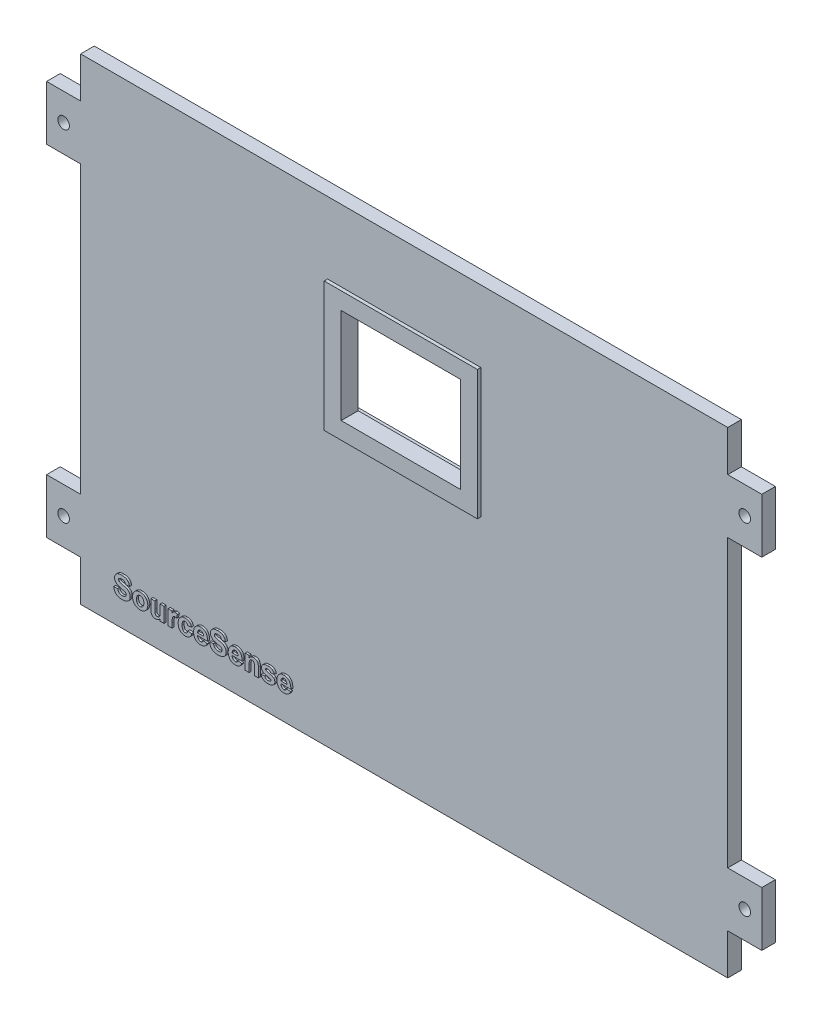
from build123d import *

# Parameters (mm, degrees)
LID_PLATE_START               = 44
SKETCH1_W                     = 190
SKETCH1_H                     = 140
LID_PLATE_DEPTH               = 4
LID_LUGS_START                = 44
SKETCH2_W                     = 10
SKETCH2_H                     = 16
LID_LUGS_DEPTH                = 4
TFT_WINDOW_DEPTH              = 136.014814002
TFT_WINDOW_DEPTH_BACK         = 136.014814002
SKETCH3_W                     = 35
SKETCH3_H                     = 28
TFT_BEZEL_START               = 48
SKETCH4_W                     = 45
SKETCH4_H                     = 38
SKETCH4_W_2                   = 35
SKETCH4_H_2                   = 28
TFT_BEZEL_DEPTH               = 1
LID_SCREW_HOLES_M3_DEPTH      = 136.373557241
LID_SCREW_HOLES_M3_DEPTH_BACK = 136.373557241
SKETCH5_R                     = 1.7
TFT_RAILS_START               = 44
SKETCH6_W                     = 50
SKETCH6_H                     = 2
TFT_RAILS_DEPTH               = 4.6
LABEL_SOURCESENSE_START       = 48
LABEL_SOURCESENSE_DEPTH       = 0.6


with BuildPart() as part:
    # Sketch1 → Lid_Plate (new body)
    with BuildSketch(Plane.XY.offset(LID_PLATE_START)):
        Rectangle(SKETCH1_W, SKETCH1_H)
    extrude(amount=LID_PLATE_DEPTH)

    # Sketch2 → Lid_Lugs (add)
    with BuildSketch(Plane.XY.offset(LID_LUGS_START)):
        with Locations((-100, -50)):
            Rectangle(SKETCH2_W, SKETCH2_H)
        with Locations((-100, 50)):
            Rectangle(SKETCH2_W, SKETCH2_H)
        with Locations((100, -50)):
            Rectangle(SKETCH2_W, SKETCH2_H)
        with Locations((100, 50)):
            Rectangle(SKETCH2_W, SKETCH2_H)
    extrude(amount=LID_LUGS_DEPTH)

    # Sketch3 → TFT_Window (cut, two sides: drawn at the far end of the back side and taken through both)
    with BuildSketch(Plane.XY.offset(-TFT_WINDOW_DEPTH_BACK)):
        with Locations((0, 30)):
            Rectangle(SKETCH3_W, SKETCH3_H)
    extrude(amount=TFT_WINDOW_DEPTH + TFT_WINDOW_DEPTH_BACK, mode=Mode.SUBTRACT)

    # Sketch4 → TFT_Bezel (add)
    with BuildSketch(Plane.XY.offset(TFT_BEZEL_START)):
        with Locations((0, 30)):
            Rectangle(SKETCH4_W, SKETCH4_H)
        with Locations((0, 30)):
            Rectangle(SKETCH4_W_2, SKETCH4_H_2, mode=Mode.SUBTRACT)
    extrude(amount=TFT_BEZEL_DEPTH)

    # Sketch5 → Lid_Screw_Holes_M3 (cut, two sides: drawn at the far end of the back side and taken through both)
    with BuildSketch(Plane.XY.offset(-LID_SCREW_HOLES_M3_DEPTH_BACK)):
        with Locations((-100, -50)):
            Circle(SKETCH5_R)
        with Locations((-100, 50)):
            Circle(SKETCH5_R)
        with Locations((100, -50)):
            Circle(SKETCH5_R)
        with Locations((100, 50)):
            Circle(SKETCH5_R)
    extrude(amount=LID_SCREW_HOLES_M3_DEPTH + LID_SCREW_HOLES_M3_DEPTH_BACK, mode=Mode.SUBTRACT)

    # Sketch6 → TFT_Rails (add)
    with BuildSketch(Plane.XY.offset(TFT_RAILS_START)):
        with Locations((0, 11.2)):
            Rectangle(SKETCH6_W, SKETCH6_H)
        with Locations((0, 48.8)):
            Rectangle(SKETCH6_W, SKETCH6_H)
    extrude(amount=-TFT_RAILS_DEPTH)

    # Sketch7 → Label_SourceSense (add)
    # profile 1 of 11: a face of its own
    with BuildSketch(Plane.XY.offset(LABEL_SOURCESENSE_START)):
        with BuildLine():
            Line((-84.692307692, -60), (-83.538461538, -59.923076923))
            add(Edge.make_bspline(
                [(-83.538461538, -59.923076923), (-83.529269173, -59.971349783), (-83.511413587, -60.065116743), (-83.471741829, -60.198747462), (-83.428074202, -60.323329192), (-83.375888995, -60.437526002), (-83.318759524, -60.543448755), (-83.251992579, -60.63807997), (-83.180245993, -60.724440978), (-83.099968172, -60.799430061), (-83.012506528, -60.865106536), (-82.917424635, -60.921117621), (-82.815752789, -60.969596228), (-82.707242389, -61.009516823), (-82.59077507, -61.039317743), (-82.467365433, -61.06051933), (-82.336836485, -61.074096241), (-82.247630344, -61.075965374), (-82.201923077, -61.076923077)],
                knots=[0, 0, 0, 0, 1.204560339, 2.339781841, 3.415289417, 4.440034832, 5.416475564, 6.362424008, 7.275913008, 8.16578645, 9.05021719, 9.95355393, 10.867835453, 11.809845306, 12.784702352, 13.812224031, 14.87903166, 16, 16, 16, 16], degree=3))
            add(Edge.make_bspline(
                [(-82.201923077, -61.076923077), (-82.153813287, -61.076398202), (-82.060237269, -61.075377294), (-81.924635271, -61.062712027), (-81.797841244, -61.04456767), (-81.680974823, -61.015845577), (-81.57185364, -60.983724462), (-81.47318781, -60.939779354), (-81.383380686, -60.889095025), (-81.302663632, -60.831581444), (-81.232221783, -60.767794755), (-81.170595738, -60.701203522), (-81.116923524, -60.63324642), (-81.074679693, -60.560907809), (-81.040492328, -60.487113363), (-81.017896873, -60.409661666), (-81.002632305, -60.330331177), (-81.000881904, -60.276114195), (-81, -60.248798077)],
                knots=[0, 0, 0, 0, 1.417779877, 2.757654889, 4.012140507, 5.189587551, 6.302846416, 7.360586765, 8.365575446, 9.33904572, 10.275781718, 11.161696098, 12.012180333, 12.822428111, 13.625933072, 14.403138519, 15.195454004, 16, 16, 16, 16], degree=3))
            add(Edge.make_bspline(
                [(-81, -60.248798077), (-81.00108158, -60.214573197), (-81.003197533, -60.147617229), (-81.028671489, -60.051896337), (-81.066873787, -59.963213697), (-81.124393247, -59.882879152), (-81.201713559, -59.809465086), (-81.300343322, -59.740788023), (-81.423035633, -59.679005527), (-81.514057367, -59.644543135), (-81.5625, -59.626201923)],
                knots=[0, 0, 0, 0, 0.90494901, 1.770400303, 2.607161909, 3.452839393, 4.36912122, 5.420987164, 6.627424851, 8, 8, 8, 8], degree=3))
            add(Edge.make_bspline(
                [(-81.5625, -59.626201923), (-81.583285451, -59.619236623), (-81.629799915, -59.603649411), (-81.70914865, -59.581361169), (-81.804726312, -59.553529076), (-81.917914054, -59.521893459), (-82.04867382, -59.489538551), (-82.195545193, -59.449680976), (-82.360318699, -59.410019431), (-82.475594442, -59.380741287), (-82.536057692, -59.365384615)],
                knots=[0, 0, 0, 0, 0.521821638, 1.167752076, 1.961721917, 2.891982557, 3.96540661, 5.168436773, 6.514817513, 8, 8, 8, 8], degree=3))
            add(Edge.make_bspline(
                [(-82.536057692, -59.365384615), (-82.614798789, -59.345724801), (-82.766716858, -59.307794405), (-82.983386812, -59.240318917), (-83.182943802, -59.173278284), (-83.363466418, -59.1005356), (-83.526945899, -59.027020832), (-83.670737915, -58.947572757), (-83.797843091, -58.866317394), (-83.871910226, -58.805585151), (-83.907451923, -58.776442308)],
                knots=[0, 0, 0, 0, 1.293880989, 2.496331788, 3.617634808, 4.64976062, 5.598842568, 6.473791081, 7.267636666, 8, 8, 8, 8], degree=3))
            add(Edge.make_bspline(
                [(-83.907451923, -58.776442308), (-83.951528247, -58.735173835), (-84.037943956, -58.654263179), (-84.151696824, -58.521311442), (-84.247280208, -58.380869203), (-84.325955798, -58.233973115), (-84.386534513, -58.079777502), (-84.429471928, -57.919314485), (-84.457262583, -57.752165274), (-84.460098428, -57.638332702), (-84.461538462, -57.580528846)],
                knots=[0, 0, 0, 0, 1.064429417, 2.086912298, 3.078678339, 4.055528992, 5.020032834, 5.993708893, 6.981211098, 8, 8, 8, 8], degree=3))
            add(Edge.make_bspline(
                [(-84.461538462, -57.580528846), (-84.458733984, -57.505731346), (-84.453170738, -57.357355434), (-84.402152143, -57.139263098), (-84.322679113, -56.92882079), (-84.230509244, -56.761721805), (-84.141953885, -56.63531079), (-84.068415106, -56.544599403), (-83.987625653, -56.459702266), (-83.898478882, -56.382690287), (-83.804285032, -56.309052435), (-83.701394672, -56.24366114), (-83.592725054, -56.182066158), (-83.435467737, -56.109048172), (-83.221955452, -56.032956259), (-82.944164498, -55.968815606), (-82.641705156, -55.930258788), (-82.432009164, -55.925528682), (-82.323317308, -55.923076923)],
                knots=[0, 0, 0, 0, 1.180131776, 2.341029169, 3.518901375, 4.725685298, 5.343762192, 5.955650671, 6.568945152, 7.192346361, 7.815201106, 8.455999361, 9.116257477, 9.787318263, 11.192748436, 12.688084276, 14.283332633, 16, 16, 16, 16], degree=3))
            add(Edge.make_bspline(
                [(-82.323317308, -55.923076923), (-82.234320324, -55.924267036), (-82.061223093, -55.92658178), (-81.81029855, -55.94998884), (-81.575921413, -55.98641916), (-81.358914137, -56.038714715), (-81.159175614, -56.107810869), (-80.975931599, -56.190117453), (-80.809337803, -56.287836022), (-80.661422343, -56.401527347), (-80.529643845, -56.526864741), (-80.414688181, -56.663769552), (-80.316115852, -56.810512756), (-80.233290684, -56.966987114), (-80.168248298, -57.133997133), (-80.120477233, -57.311334418), (-80.088881037, -57.49858156), (-80.080961354, -57.626885172), (-80.076923077, -57.692307692)],
                knots=[0, 0, 0, 0, 1.325124071, 2.577337985, 3.749592149, 4.855247722, 5.896868755, 6.892903601, 7.842551483, 8.766257401, 9.665194363, 10.546067736, 11.423174165, 12.293291263, 13.177512979, 14.086532529, 15.024315359, 16, 16, 16, 16], degree=3))
            Line((-80.076923077, -57.692307692), (-81.230769231, -57.769230769))
            add(Edge.make_bspline(
                [(-81.230769231, -57.769230769), (-81.237425478, -57.733049248), (-81.250397811, -57.662535227), (-81.278603216, -57.561544823), (-81.310417545, -57.468140218), (-81.347654568, -57.382322011), (-81.392632392, -57.305627288), (-81.441581191, -57.235643193), (-81.495851238, -57.173302224), (-81.557239436, -57.120311478), (-81.623636223, -57.07209207), (-81.69930516, -57.033443099), (-81.781075635, -56.997585361), (-81.87205852, -56.970629135), (-81.970506611, -56.949246488), (-82.076477254, -56.933394784), (-82.190190113, -56.92565509), (-82.268420368, -56.923955986), (-82.308894231, -56.923076923)],
                knots=[0, 0, 0, 0, 1.151066407, 2.24330871, 3.278475654, 4.238599069, 5.165719782, 6.056502506, 6.909492653, 7.744782051, 8.590364415, 9.471203867, 10.39832458, 11.382154319, 12.435022857, 13.550631277, 14.73277401, 16, 16, 16, 16], degree=3))
            add(Edge.make_bspline(
                [(-82.308894231, -56.923076923), (-82.350975995, -56.923852991), (-82.432847947, -56.925362865), (-82.552157202, -56.934628742), (-82.664078235, -56.951732659), (-82.769160722, -56.973997715), (-82.867264297, -57.004287784), (-82.958181931, -57.041221562), (-83.04232958, -57.084703989), (-83.093639148, -57.118914461), (-83.118990385, -57.135817308)],
                knots=[0, 0, 0, 0, 1.186678824, 2.308736671, 3.37120409, 4.377216403, 5.334874112, 6.262130804, 7.141346615, 8, 8, 8, 8], degree=3))
            add(Edge.make_bspline(
                [(-83.118990385, -57.135817308), (-83.148002747, -57.158907077), (-83.204190687, -57.203624794), (-83.2646608, -57.292418975), (-83.301063948, -57.39270934), (-83.305445479, -57.463631472), (-83.307692308, -57.5)],
                knots=[0, 0, 0, 0, 1.037857257, 2.010007357, 2.979541333, 4, 4, 4, 4], degree=3))
            add(Edge.make_bspline(
                [(-83.307692308, -57.5), (-83.305854812, -57.533988804), (-83.302235237, -57.60094134), (-83.265727164, -57.696048866), (-83.209582721, -57.78417283), (-83.157124948, -57.832042922), (-83.129807692, -57.856971154)],
                knots=[0, 0, 0, 0, 0.98538058, 1.941042925, 2.927803204, 4, 4, 4, 4], degree=3))
            add(Edge.make_bspline(
                [(-83.129807692, -57.856971154), (-83.10812793, -57.873150827), (-83.059682686, -57.909305662), (-82.970940602, -57.955261877), (-82.863826577, -58.005035235), (-82.73589867, -58.053694188), (-82.588007089, -58.102262816), (-82.420142838, -58.152974079), (-82.232202674, -58.204366189), (-82.0289771, -58.254136929), (-81.822645904, -58.303058709), (-81.62574973, -58.356544021), (-81.442664602, -58.408688064), (-81.274239435, -58.463343483), (-81.119606027, -58.516550364), (-80.979515534, -58.571197662), (-80.85300604, -58.624418017), (-80.705481944, -58.697599773), (-80.538278219, -58.796727421), (-80.363029854, -58.940825988), (-80.208045037, -59.102802188), (-80.100055736, -59.255534572), (-80.025872737, -59.386888487), (-79.978106713, -59.491592852), (-79.936785355, -59.601924851), (-79.903149882, -59.71800641), (-79.878772258, -59.840000869), (-79.858598355, -59.966976189), (-79.848291134, -60.099986929), (-79.846873943, -60.190690788), (-79.846153846, -60.236778846)],
                knots=[0, 0, 0, 0, 0.511875881, 1.143829537, 1.88775736, 2.750598373, 3.734912702, 4.837306479, 6.073130119, 7.42648979, 8.801963576, 10.091065733, 11.292408984, 12.408830014, 13.446061236, 14.39066453, 15.257936293, 16.045629259, 17.510392066, 18.929669597, 20.331293837, 21.746891395, 22.460690638, 23.187651344, 23.925159671, 24.69163991, 25.474819891, 26.281170188, 27.126635539, 28, 28, 28, 28], degree=3))
            add(Edge.make_bspline(
                [(-79.846153846, -60.236778846), (-79.847144003, -60.279282339), (-79.849110357, -60.36369016), (-79.862851777, -60.488972674), (-79.884102539, -60.612030402), (-79.915560968, -60.733017612), (-79.957293783, -60.851696297), (-80.004281617, -60.969779318), (-80.063037258, -61.084691533), (-80.12990919, -61.196528117), (-80.203671971, -61.305205145), (-80.287258901, -61.405457227), (-80.375760413, -61.500629016), (-80.474831517, -61.585391421), (-80.578354349, -61.666607703), (-80.691063938, -61.738534206), (-80.810319662, -61.803621324), (-80.936875553, -61.861383115), (-81.071180324, -61.911717295), (-81.213059539, -61.956518214), (-81.363791445, -61.993184325), (-81.522119152, -62.024611802), (-81.688622071, -62.048511586), (-81.863092034, -62.065199192), (-82.045568706, -62.074609996), (-82.169861309, -62.07614247), (-82.233173077, -62.076923077)],
                knots=[0, 0, 0, 0, 0.900570041, 1.788444861, 2.667795364, 3.545012114, 4.433698372, 5.332345486, 6.235991676, 7.164928091, 8.092777575, 9.015680987, 9.928493428, 10.842962589, 11.775229507, 12.714851019, 13.672254427, 14.652424454, 15.660007982, 16.709910502, 17.803296389, 18.945495772, 20.129342395, 21.366102753, 22.658353839, 24, 24, 24, 24], degree=3))
            add(Edge.make_bspline(
                [(-82.233173077, -62.076923077), (-82.324585502, -62.075430614), (-82.502567661, -62.072524752), (-82.761143773, -62.046515006), (-83.003671048, -62.006705214), (-83.229754671, -61.948927777), (-83.439670969, -61.874754589), (-83.633324204, -61.7833896), (-83.809777696, -61.674286953), (-83.971216916, -61.550092568), (-84.115490939, -61.408543313), (-84.245222433, -61.252572035), (-84.35866128, -61.080774238), (-84.45573292, -60.893418636), (-84.53889149, -60.691518073), (-84.607473163, -60.474979837), (-84.659111559, -60.242771159), (-84.681050939, -60.082323295), (-84.692307692, -60)],
                knots=[0, 0, 0, 0, 1.217954099, 2.371385517, 3.459848295, 4.490682126, 5.476952527, 6.422732854, 7.338496285, 8.236688651, 9.131557988, 10.026443255, 10.935708282, 11.869506048, 12.834296687, 13.842423496, 14.892981177, 16, 16, 16, 16], degree=3))
        make_face()
    # profile 2 of 11: a face of its own
    with BuildSketch(Plane.XY.offset(LABEL_SOURCESENSE_START)):
        with BuildLine():
            add(Edge.make_bspline(
                [(-79.153846154, -59.746394231), (-79.150144238, -59.651630774), (-79.142733231, -59.461920175), (-79.089797362, -59.180115008), (-79.000195109, -58.903966817), (-78.899899229, -58.679911174), (-78.800866919, -58.508622161), (-78.720892013, -58.385104756), (-78.631608754, -58.270866668), (-78.534844527, -58.165183954), (-78.432776016, -58.065523058), (-78.321809245, -57.975550252), (-78.203379405, -57.893715161), (-78.078642869, -57.819115003), (-77.947777959, -57.753614034), (-77.813214204, -57.695390323), (-77.67440782, -57.647550067), (-77.532325921, -57.607877085), (-77.386352406, -57.576057946), (-77.236447017, -57.555225474), (-77.082791291, -57.541334469), (-76.979197794, -57.539427995), (-76.926682692, -57.538461538)],
                knots=[0, 0, 0, 0, 1.619840069, 3.242819969, 4.882696853, 6.574901176, 7.427927767, 8.263869039, 9.088735507, 9.903385011, 10.712399333, 11.525463381, 12.34252837, 13.171904741, 14.008210778, 14.842888174, 15.67691885, 16.516221154, 17.363978437, 18.229048737, 19.10224397, 20, 20, 20, 20], degree=3))
            add(Edge.make_bspline(
                [(-76.926682692, -57.538461538), (-76.84686051, -57.540168676), (-76.689833948, -57.543526966), (-76.45995592, -57.574117029), (-76.24141756, -57.624513489), (-76.03392395, -57.694685953), (-75.837318694, -57.784641574), (-75.65259074, -57.89645501), (-75.478213886, -58.02684572), (-75.317488551, -58.176609016), (-75.170578179, -58.340590827), (-75.043164062, -58.517870623), (-74.934414447, -58.705019076), (-74.844345739, -58.902333707), (-74.775978023, -59.110855809), (-74.72874579, -59.330074945), (-74.697117634, -59.559178008), (-74.693931451, -59.715836139), (-74.692307692, -59.795673077)],
                knots=[0, 0, 0, 0, 1.076054793, 2.116819909, 3.120736197, 4.09633837, 5.065772102, 6.030360709, 7.002891056, 7.996945094, 8.988102315, 9.967288529, 10.93568283, 11.902870597, 12.887008047, 13.888537105, 14.923945207, 16, 16, 16, 16], degree=3))
            add(Edge.make_bspline(
                [(-74.692307692, -59.795673077), (-74.693937917, -59.876307593), (-74.697129239, -60.034157395), (-74.728569062, -60.26538776), (-74.777184462, -60.48654449), (-74.846947768, -60.697178986), (-74.936823422, -60.897049594), (-75.04510038, -61.086839009), (-75.174647033, -61.26554914), (-75.322979837, -61.431317365), (-75.485781445, -61.581900266), (-75.658906006, -61.715765979), (-75.844442473, -61.826125653), (-76.039136222, -61.918926197), (-76.244990358, -61.989350891), (-76.460832058, -62.039583818), (-76.686496734, -62.072345232), (-76.840828884, -62.075377791), (-76.919471154, -62.076923077)],
                knots=[0, 0, 0, 0, 1.084306555, 2.122634113, 3.133511532, 4.127271514, 5.10202058, 6.077484774, 7.061903265, 8.065960046, 9.065303363, 10.042062392, 11.004391854, 11.964060687, 12.939122686, 13.924942149, 14.942623041, 16, 16, 16, 16], degree=3))
            add(Edge.make_bspline(
                [(-76.919471154, -62.076923077), (-77.017442954, -62.073713698), (-77.212689455, -62.067317776), (-77.501613228, -62.014855478), (-77.78340044, -61.930210025), (-78.010422101, -61.832780051), (-78.183841733, -61.737772965), (-78.306826462, -61.65779911), (-78.422812076, -61.571972358), (-78.529084715, -61.475878672), (-78.627478515, -61.372277347), (-78.719296926, -61.26217148), (-78.801270604, -61.143019588), (-78.875689192, -61.016986445), (-78.942465886, -60.883171232), (-78.998133865, -60.741206329), (-79.046499174, -60.592759216), (-79.086389284, -60.437492802), (-79.115967461, -60.27474131), (-79.137473689, -60.105026229), (-79.150950594, -59.928100434), (-79.152868961, -59.807716381), (-79.153846154, -59.746394231)],
                knots=[0, 0, 0, 0, 1.610846835, 3.210231987, 4.81374032, 6.443368681, 7.263437361, 8.06418174, 8.855100662, 9.634539345, 10.417731031, 11.204243685, 11.990424874, 12.794120493, 13.610605693, 14.447765341, 15.300248309, 16.177865431, 17.082777535, 18.019649293, 18.991233806, 20, 20, 20, 20], degree=3))
        make_face()
        with BuildLine():
            add(Edge.make_bspline(
                [(-78, -59.807692308), (-77.999144848, -59.863417801), (-77.997480722, -59.971859624), (-77.982648874, -60.12963564), (-77.959660272, -60.277796379), (-77.924159475, -60.414964536), (-77.881348997, -60.542993692), (-77.827005761, -60.660181045), (-77.764908927, -60.768745995), (-77.691006753, -60.864627458), (-77.610460554, -60.949501738), (-77.526040316, -61.02491732), (-77.436918029, -61.089133173), (-77.342546302, -61.141342297), (-77.243041785, -61.180977241), (-77.139578775, -61.210061139), (-77.031413167, -61.227147071), (-76.957992477, -61.229548563), (-76.920673077, -61.230769231)],
                knots=[0, 0, 0, 0, 1.334287467, 2.596523749, 3.792235791, 4.920928783, 5.98599801, 7.020725633, 8.009778093, 8.975087571, 9.91178927, 10.809031968, 11.682407688, 12.537028737, 13.385161363, 14.241880569, 15.106355953, 16, 16, 16, 16], degree=3))
            add(Edge.make_bspline(
                [(-76.920673077, -61.230769231), (-76.883352059, -61.22955257), (-76.809928187, -61.22715896), (-76.70178578, -61.210015562), (-76.598594706, -61.181245848), (-76.499734629, -61.141018439), (-76.405607076, -61.089180567), (-76.316540285, -61.02487434), (-76.232180934, -60.949812798), (-76.152289726, -60.864480605), (-76.080525686, -60.767293579), (-76.017820343, -60.659067547), (-75.963478784, -60.541431612), (-75.920470502, -60.412723366), (-75.886915344, -60.273976604), (-75.86338339, -60.124853556), (-75.848671266, -59.965439993), (-75.847010212, -59.85580292), (-75.846153846, -59.799278846)],
                knots=[0, 0, 0, 0, 0.891374549, 1.753654511, 2.608197993, 3.445305504, 4.297756158, 5.168913853, 6.063877914, 6.991658187, 7.956416983, 8.942957645, 9.975057474, 11.046479855, 12.179282068, 13.381405243, 14.649967197, 16, 16, 16, 16], degree=3))
            add(Edge.make_bspline(
                [(-75.846153846, -59.799278846), (-75.847014462, -59.743957249), (-75.848682701, -59.636720525), (-75.863311879, -59.480884362), (-75.887236915, -59.334647902), (-75.920213109, -59.198158718), (-75.96370201, -59.071183669), (-76.018160587, -58.954897165), (-76.080113385, -58.846986083), (-76.152709214, -58.750816045), (-76.232130195, -58.665534454), (-76.316553287, -58.590519849), (-76.405603713, -58.526201572), (-76.499735503, -58.47436682), (-76.598594468, -58.434138592), (-76.701785845, -58.405369101), (-76.80992817, -58.388225643), (-76.883352054, -58.385832042), (-76.920673077, -58.384615385)],
                knots=[0, 0, 0, 0, 1.332105243, 2.582185114, 3.76554119, 4.898206757, 5.96011018, 6.991864232, 7.986448439, 8.951336849, 9.886681577, 10.788942532, 11.667203022, 12.526603947, 13.370536632, 14.232047448, 15.101357822, 16, 16, 16, 16], degree=3))
            add(Edge.make_bspline(
                [(-76.920673077, -58.384615385), (-76.957992477, -58.385836052), (-77.031413167, -58.388237544), (-77.139578775, -58.405323476), (-77.243041785, -58.434407375), (-77.342546302, -58.474042318), (-77.436918029, -58.526251442), (-77.526040316, -58.590467295), (-77.610460554, -58.665882877), (-77.691006753, -58.750757158), (-77.764908927, -58.84663862), (-77.827005761, -58.955203571), (-77.881348997, -59.072390924), (-77.924159475, -59.20042008), (-77.959660272, -59.337588237), (-77.982648874, -59.485748975), (-77.997480722, -59.643524992), (-77.999144848, -59.751966815), (-78, -59.807692308)],
                knots=[0, 0, 0, 0, 0.893644047, 1.758119431, 2.614838637, 3.462971263, 4.317592312, 5.190968032, 6.08821073, 7.024912429, 7.990221907, 8.979274367, 10.01400199, 11.079071217, 12.207764209, 13.403476251, 14.665712533, 16, 16, 16, 16], degree=3))
        make_face(mode=Mode.SUBTRACT)
    # profile 3 of 11: a face of its own
    with BuildSketch(Plane.XY.offset(LABEL_SOURCESENSE_START)):
        with BuildLine():
            Line((-71.076923077, -62), (-71.076923077, -61.354567308))
            add(Edge.make_bspline(
                [(-71.076923077, -61.354567308), (-71.115125547, -61.409809984), (-71.190933553, -61.51943214), (-71.330246658, -61.663082415), (-71.486253884, -61.787728628), (-71.65786793, -61.891611204), (-71.839819306, -61.974466124), (-72.02906107, -62.033955691), (-72.223407776, -62.069692085), (-72.354822638, -62.074509251), (-72.420673077, -62.076923077)],
                knots=[0, 0, 0, 0, 1.012300957, 2.008784164, 3.006972158, 4.019128624, 5.028517728, 6.017265291, 7.006475003, 8, 8, 8, 8], degree=3))
            add(Edge.make_bspline(
                [(-72.420673077, -62.076923077), (-72.487347532, -62.074715971), (-72.618106303, -62.070387501), (-72.808629227, -62.033280451), (-72.988474609, -61.972631085), (-73.156747684, -61.889234365), (-73.307823761, -61.782492575), (-73.439346499, -61.656107835), (-73.545633279, -61.508114815), (-73.61623006, -61.370507713), (-73.660531709, -61.249523873), (-73.68885504, -61.149301391), (-73.714531888, -61.040752583), (-73.734233524, -60.923870192), (-73.750216804, -60.798785553), (-73.760259219, -60.665584775), (-73.768057821, -60.52372846), (-73.768832498, -60.426294147), (-73.769230769, -60.376201923)],
                knots=[0, 0, 0, 0, 1.289498181, 2.528902495, 3.740215999, 4.953909685, 6.150063847, 7.307074614, 8.467199117, 9.660131987, 10.288158488, 10.958106275, 11.674712228, 12.445953132, 13.25095176, 14.114470792, 15.030625377, 16, 16, 16, 16], degree=3))
            Line((-73.769230769, -60.376201923), (-73.769230769, -57.615384615))
            Line((-73.769230769, -57.615384615), (-72.615384615, -57.615384615))
            Line((-72.615384615, -57.615384615), (-72.615384615, -59.638221154))
            add(Edge.make_bspline(
                [(-72.615384615, -59.638221154), (-72.615046296, -59.711938881), (-72.614404576, -59.851766058), (-72.612536378, -60.050511618), (-72.607410071, -60.226389019), (-72.60193387, -60.379895189), (-72.593813886, -60.510977702), (-72.583285197, -60.619631447), (-72.571532152, -60.705867572), (-72.555463046, -60.789936993), (-72.522470154, -60.8743138), (-72.477025172, -60.964950232), (-72.414900235, -61.042751617), (-72.343033571, -61.110324023), (-72.259287329, -61.166316965), (-72.162685768, -61.201673321), (-72.057489373, -61.228064309), (-71.983361245, -61.229842236), (-71.944711538, -61.230769231)],
                knots=[0, 0, 0, 0, 1.799930418, 3.414093185, 4.852592097, 6.095879458, 7.164323302, 8.058836106, 8.760219181, 9.289718358, 10.143846288, 10.96209893, 11.756558504, 12.559405005, 13.365225682, 14.195378484, 15.059087384, 16, 16, 16, 16], degree=3))
            add(Edge.make_bspline(
                [(-71.944711538, -61.230769231), (-71.900085109, -61.228545195), (-71.812206375, -61.224165605), (-71.683770785, -61.193644866), (-71.563823436, -61.140639958), (-71.451976797, -61.070132848), (-71.354055013, -60.982837725), (-71.269023758, -60.885878432), (-71.202787396, -60.778129671), (-71.160552348, -60.677707909), (-71.135242954, -60.58259689), (-71.121356324, -60.488196699), (-71.106120099, -60.372932645), (-71.096803708, -60.235229032), (-71.086327454, -60.075849122), (-71.08126915, -59.894255033), (-71.077462551, -59.690722963), (-71.077109162, -59.547679085), (-71.076923077, -59.472355769)],
                knots=[0, 0, 0, 0, 0.960139447, 1.890714513, 2.821289579, 3.770841791, 4.723832156, 5.63466777, 6.536687779, 7.433335375, 7.968708987, 8.650470788, 9.484586637, 10.470508532, 11.619255361, 12.921832212, 14.379114108, 16, 16, 16, 16], degree=3))
            Line((-71.076923077, -59.472355769), (-71.076923077, -57.615384615))
            Line((-71.076923077, -57.615384615), (-69.923076923, -57.615384615))
            Line((-69.923076923, -57.615384615), (-69.923076923, -62))
            Line((-69.923076923, -62), (-71.076923077, -62))
        make_face()
    # profile 4 of 11: a face of its own
    with BuildSketch(Plane.XY.offset(LABEL_SOURCESENSE_START)):
        with BuildLine():
            Line((-67.538461538, -62), (-68.692307692, -62))
            Line((-68.692307692, -62), (-68.692307692, -57.615384615))
            Line((-68.692307692, -57.615384615), (-67.538461538, -57.615384615))
            Line((-67.538461538, -57.615384615), (-67.538461538, -58.227163462))
            add(Edge.make_bspline(
                [(-67.538461538, -58.227163462), (-67.518525041, -58.192653448), (-67.480062825, -58.126075474), (-67.423167401, -58.031130015), (-67.366547844, -57.946513333), (-67.310728448, -57.872224527), (-67.25897253, -57.805476895), (-67.206318166, -57.750036803), (-67.156849547, -57.70240343), (-67.090661592, -57.654784756), (-67.005715303, -57.608310116), (-66.89894907, -57.566534558), (-66.784605654, -57.543702001), (-66.706824422, -57.540234114), (-66.667067308, -57.538461538)],
                knots=[0, 0, 0, 0, 1.218987753, 2.351715484, 3.384890168, 4.330893419, 5.1939795, 5.965577503, 6.66790098, 7.29043559, 8.453252551, 9.620708942, 10.783848683, 12, 12, 12, 12], degree=3))
            add(Edge.make_bspline(
                [(-66.667067308, -57.538461538), (-66.609506739, -57.541693061), (-66.493897714, -57.548183496), (-66.322633163, -57.594543618), (-66.156109948, -57.673020882), (-66.053128707, -57.744416517), (-66, -57.78125)],
                knots=[0, 0, 0, 0, 0.956058025, 1.920219652, 2.927027487, 4, 4, 4, 4], degree=3))
            Line((-66, -57.78125), (-66.269230769, -58.878605769))
            add(Edge.make_bspline(
                [(-66.269230769, -58.878605769), (-66.314611275, -58.850064083), (-66.40106988, -58.795686675), (-66.536021139, -58.737917473), (-66.665821226, -58.700095981), (-66.751772474, -58.69484354), (-66.793269231, -58.692307692)],
                knots=[0, 0, 0, 0, 1.139741959, 2.17142794, 3.117176162, 4, 4, 4, 4], degree=3))
            add(Edge.make_bspline(
                [(-66.793269231, -58.692307692), (-66.830668156, -58.693905305), (-66.903473773, -58.697015425), (-67.008280834, -58.721783849), (-67.104906762, -58.761689459), (-67.19373571, -58.819054611), (-67.273175596, -58.899288401), (-67.34156672, -59.004985944), (-67.39880478, -59.137122724), (-67.442553164, -59.265381572), (-67.469831942, -59.390044262), (-67.489069343, -59.50874835), (-67.503685922, -59.650854499), (-67.517066364, -59.81593203), (-67.526035345, -60.00434579), (-67.53309603, -60.215502664), (-67.538195701, -60.449895832), (-67.538370229, -60.613779146), (-67.538461538, -60.699519231)],
                knots=[0, 0, 0, 0, 0.752818562, 1.4655346, 2.15662141, 2.850671748, 3.581264886, 4.414089304, 5.371394652, 6.476667933, 7.138571115, 7.940099809, 8.898357565, 10.015825393, 11.276710544, 12.698206094, 14.272575274, 16, 16, 16, 16], degree=3))
            Line((-67.538461538, -60.699519231), (-67.538461538, -62))
        make_face()
    # profile 5 of 11: a face of its own
    with BuildSketch(Plane.XY.offset(LABEL_SOURCESENSE_START)):
        with BuildLine():
            Line((-61.846153846, -58.923076923), (-63, -59.076923077))
            add(Edge.make_bspline(
                [(-63, -59.076923077), (-63.010604985, -59.022888183), (-63.03083679, -58.91980238), (-63.082134826, -58.777045909), (-63.152293337, -58.655710713), (-63.24003278, -58.556578623), (-63.343308537, -58.479328356), (-63.46061261, -58.422995924), (-63.593201554, -58.390227452), (-63.686112233, -58.386533974), (-63.734375, -58.384615385)],
                knots=[0, 0, 0, 0, 1.183520367, 2.2578771, 3.246797608, 4.180863388, 5.085846032, 6.003342148, 6.962829327, 8, 8, 8, 8], degree=3))
            add(Edge.make_bspline(
                [(-63.734375, -58.384615385), (-63.767273071, -58.38551866), (-63.831398995, -58.387279352), (-63.92519885, -58.401630185), (-64.0130676, -58.427646745), (-64.097251718, -58.460759135), (-64.17498325, -58.505861296), (-64.248564964, -58.559172103), (-64.315692773, -58.623636864), (-64.378622051, -58.697317174), (-64.436482481, -58.782289738), (-64.483370513, -58.881734121), (-64.524483883, -58.993107937), (-64.557897938, -59.117860162), (-64.583659325, -59.255725705), (-64.603048363, -59.406578815), (-64.613409029, -59.5703652), (-64.614709663, -59.68388063), (-64.615384615, -59.742788462)],
                knots=[0, 0, 0, 0, 0.862078219, 1.680389174, 2.478024961, 3.259954283, 4.04533088, 4.826625376, 5.636266677, 6.477958853, 7.363321064, 8.321359119, 9.351280941, 10.472100686, 11.701575432, 13.024867311, 14.456081111, 16, 16, 16, 16], degree=3))
            add(Edge.make_bspline(
                [(-64.615384615, -59.742788462), (-64.614865918, -59.808115385), (-64.613865739, -59.93408218), (-64.601407322, -60.115753913), (-64.582840903, -60.28231713), (-64.556678527, -60.434229573), (-64.522307367, -60.570956526), (-64.480161182, -60.693209722), (-64.431944866, -60.80140057), (-64.372782474, -60.893484897), (-64.309387034, -60.974048602), (-64.238001661, -61.041257064), (-64.164293125, -61.10166474), (-64.082370869, -61.14785082), (-63.997112057, -61.186446098), (-63.905182597, -61.210444877), (-63.80923125, -61.228913394), (-63.742885369, -61.230143477), (-63.709134615, -61.230769231)],
                knots=[0, 0, 0, 0, 1.594318435, 3.074248329, 4.44256617, 5.683784585, 6.834147545, 7.879495874, 8.83778105, 9.716843238, 10.544636748, 11.333080285, 12.105903466, 12.864046512, 13.621684801, 14.38335177, 15.177596319, 16, 16, 16, 16], degree=3))
            add(Edge.make_bspline(
                [(-63.709134615, -61.230769231), (-63.659614049, -61.228640099), (-63.563565506, -61.224510502), (-63.427177245, -61.187510868), (-63.304669668, -61.127593279), (-63.215833496, -61.057146782), (-63.151318474, -60.989302825), (-63.109296024, -60.926811148), (-63.067021033, -60.85843803), (-63.032331387, -60.779318673), (-62.997783615, -60.693231673), (-62.970145702, -60.597448905), (-62.94269399, -60.494399755), (-62.929755942, -60.421993648), (-62.923076923, -60.384615385)],
                knots=[0, 0, 0, 0, 1.391704634, 2.699306801, 3.945045311, 5.206156062, 5.868460975, 6.572467336, 7.320954464, 8.128297893, 8.999513781, 9.930638866, 10.931732014, 12, 12, 12, 12], degree=3))
            Line((-62.923076923, -60.384615385), (-61.769230769, -60.538461538))
            add(Edge.make_bspline(
                [(-61.769230769, -60.538461538), (-61.784420778, -60.599991649), (-61.814190572, -60.720580037), (-61.87205094, -60.893748396), (-61.939589192, -61.05560558), (-62.016021654, -61.206608819), (-62.104203909, -61.345127129), (-62.201688845, -61.472116032), (-62.309546881, -61.586823552), (-62.426390202, -61.691047207), (-62.554040931, -61.782637416), (-62.692694776, -61.860856048), (-62.840325856, -61.928703408), (-62.999366867, -61.982124233), (-63.167840459, -62.026144994), (-63.347345799, -62.055137789), (-63.536863653, -62.07375674), (-63.666619823, -62.075849618), (-63.733173077, -62.076923077)],
                knots=[0, 0, 0, 0, 1.110268429, 2.175934317, 3.195555169, 4.181481111, 5.137790904, 6.068820232, 6.982751273, 7.892872169, 8.808581235, 9.729898078, 10.678730826, 11.651191499, 12.666063818, 13.726769105, 14.834036833, 16, 16, 16, 16], degree=3))
            add(Edge.make_bspline(
                [(-63.733173077, -62.076923077), (-63.80898263, -62.075084096), (-63.956718698, -62.07150033), (-64.172480481, -62.043342735), (-64.376459525, -61.997054889), (-64.568698658, -61.930085997), (-64.750011872, -61.84658324), (-64.918534546, -61.741709465), (-65.075183392, -61.618655166), (-65.219592647, -61.477775116), (-65.349553729, -61.320602268), (-65.461743805, -61.147241089), (-65.556939508, -60.959855741), (-65.635387762, -60.758256056), (-65.69522019, -60.5414816), (-65.73768781, -60.310631244), (-65.765087506, -60.065560851), (-65.767825898, -59.897511888), (-65.769230769, -59.811298077)],
                knots=[0, 0, 0, 0, 1.056003706, 2.057917874, 3.026125023, 3.965316587, 4.889355399, 5.801804771, 6.724223409, 7.659808022, 8.607570672, 9.559810849, 10.530974559, 11.531347954, 12.568834288, 13.659317828, 14.799164681, 16, 16, 16, 16], degree=3))
            add(Edge.make_bspline(
                [(-65.769230769, -59.811298077), (-65.767822244, -59.724283395), (-65.765076141, -59.554636877), (-65.737754715, -59.307567112), (-65.695333178, -59.075069185), (-65.6349892, -58.857459424), (-65.55872904, -58.654343291), (-65.462817183, -58.466994826), (-65.350802742, -58.293550417), (-65.220733701, -58.136474434), (-65.076754935, -57.995467333), (-64.919167465, -57.8734055), (-64.750240764, -57.769105235), (-64.568406892, -57.685016452), (-64.374863445, -57.618182606), (-64.1688498, -57.572064016), (-63.95070126, -57.543883688), (-63.801369782, -57.54030003), (-63.724759615, -57.538461538)],
                knots=[0, 0, 0, 0, 1.206261992, 2.351765734, 3.442553085, 4.480484798, 5.479315179, 6.445885781, 7.393622348, 8.336902565, 9.26806234, 10.182699256, 11.09556262, 12.0152312, 12.955233282, 13.92969179, 14.937888647, 16, 16, 16, 16], degree=3))
            add(Edge.make_bspline(
                [(-63.724759615, -57.538461538), (-63.662211424, -57.53909923), (-63.540077322, -57.540344413), (-63.361947662, -57.558338316), (-63.19347308, -57.583721748), (-63.034782375, -57.621394508), (-62.885804884, -57.668934243), (-62.746795343, -57.727780272), (-62.618320006, -57.798372092), (-62.498751108, -57.878707918), (-62.388791924, -57.971338571), (-62.28617392, -58.073487605), (-62.19204236, -58.187658151), (-62.105290366, -58.312301083), (-62.028802491, -58.44942086), (-61.958495618, -58.596430622), (-61.897482147, -58.755439896), (-61.863517348, -58.866368134), (-61.846153846, -58.923076923)],
                knots=[0, 0, 0, 0, 1.178528697, 2.301242291, 3.371523624, 4.388184023, 5.372173667, 6.316227488, 7.228761945, 8.131556558, 9.02696084, 9.934795517, 10.857276148, 11.812560878, 12.793328268, 13.813516901, 14.882225015, 16, 16, 16, 16], degree=3))
        make_face()
    # profile 6 of 11: a face of its own
    with BuildSketch(Plane.XY.offset(LABEL_SOURCESENSE_START)):
        with BuildLine():
            Line((-58.384615385, -60.615384615), (-57.230769231, -60.769230769))
            add(Edge.make_bspline(
                [(-57.230769231, -60.769230769), (-57.249641997, -60.821217529), (-57.286749879, -60.923434582), (-57.354546221, -61.069183787), (-57.430329187, -61.205213479), (-57.513734448, -61.332250461), (-57.604451604, -61.450460479), (-57.705480323, -61.557356896), (-57.811898957, -61.656919109), (-57.928158953, -61.744406287), (-58.051347254, -61.823086265), (-58.182082938, -61.891930414), (-58.321411528, -61.947997836), (-58.467223137, -61.994950509), (-58.620179621, -62.032428192), (-58.780905012, -62.058628777), (-58.949193103, -62.074547479), (-59.064066799, -62.076121233), (-59.122596154, -62.076923077)],
                knots=[0, 0, 0, 0, 1.071172907, 2.106154283, 3.1104349, 4.085737425, 5.048416355, 5.993087888, 6.932482331, 7.868664062, 8.80754521, 9.762367971, 10.726735429, 11.713584758, 12.728370439, 13.774815933, 14.866245336, 16, 16, 16, 16], degree=3))
            add(Edge.make_bspline(
                [(-59.122596154, -62.076923077), (-59.214058071, -62.074665626), (-59.391670155, -62.07028183), (-59.648633565, -62.035053493), (-59.887297941, -61.977697384), (-60.108122945, -61.897358985), (-60.310374599, -61.791975169), (-60.494357453, -61.663830751), (-60.660432324, -61.512647231), (-60.753517552, -61.395593987), (-60.800480769, -61.336538462)],
                knots=[0, 0, 0, 0, 1.150944905, 2.235047425, 3.25761485, 4.235688044, 5.185329112, 6.119879054, 7.051444229, 8, 8, 8, 8], degree=3))
            add(Edge.make_bspline(
                [(-60.800480769, -61.336538462), (-60.835139636, -61.286282567), (-60.904932475, -61.185081867), (-60.991687538, -61.02110114), (-61.065870372, -60.847873122), (-61.124969088, -60.664901615), (-61.174096497, -60.472881821), (-61.207150087, -60.270593842), (-61.22620117, -60.058462196), (-61.229225944, -59.913901398), (-61.230769231, -59.840144231)],
                knots=[0, 0, 0, 0, 0.92479112, 1.862259343, 2.806490716, 3.778329015, 4.774107667, 5.808532634, 6.881879269, 8, 8, 8, 8], degree=3))
            add(Edge.make_bspline(
                [(-61.230769231, -59.840144231), (-61.229499988, -59.752711775), (-61.227018756, -59.581790722), (-61.197642956, -59.333330061), (-61.15619202, -59.098377188), (-61.092976548, -58.879373012), (-61.013965665, -58.673819344), (-60.914803937, -58.484359505), (-60.800423632, -58.307547254), (-60.666686916, -58.148722522), (-60.520127816, -58.00591417), (-60.364161442, -57.880076052), (-60.197620216, -57.774967928), (-60.022984727, -57.687239836), (-59.837349171, -57.621573413), (-59.643036946, -57.573234303), (-59.43919845, -57.543796437), (-59.300177258, -57.54025849), (-59.229567308, -57.538461538)],
                knots=[0, 0, 0, 0, 1.222152375, 2.389176539, 3.494777592, 4.555389183, 5.572001132, 6.56945427, 7.540785438, 8.511469914, 9.46642023, 10.399267108, 11.30862844, 12.215760073, 13.126777173, 14.056336669, 15.012798191, 16, 16, 16, 16], degree=3))
            add(Edge.make_bspline(
                [(-59.229567308, -57.538461538), (-59.15054044, -57.540132393), (-58.995893142, -57.543402081), (-58.770417944, -57.574097599), (-58.557530561, -57.624024585), (-58.357926389, -57.695766798), (-58.170303835, -57.785728054), (-57.996058315, -57.897216866), (-57.835180883, -58.029215087), (-57.688068829, -58.181666435), (-57.554929913, -58.353568475), (-57.441607939, -58.548237061), (-57.346741787, -58.76366013), (-57.269832517, -59.000393073), (-57.212974391, -59.258931496), (-57.174069688, -59.538602575), (-57.151882975, -59.839380647), (-57.153178117, -60.046838767), (-57.153846154, -60.153846154)],
                knots=[0, 0, 0, 0, 0.994942504, 1.946998194, 2.860087576, 3.744358974, 4.613292, 5.475605888, 6.343365869, 7.228414471, 8.138836547, 9.075277299, 10.058013037, 11.098483422, 12.205225682, 13.387753975, 14.652597341, 16, 16, 16, 16], degree=3))
            Line((-57.153846154, -60.153846154), (-60.076923077, -60.153846154))
            add(Edge.make_bspline(
                [(-60.076923077, -60.153846154), (-60.075030778, -60.195145262), (-60.071345865, -60.275567873), (-60.057387734, -60.393124001), (-60.033223825, -60.503161968), (-60.001601094, -60.606349359), (-59.963998587, -60.702758583), (-59.916165222, -60.79146387), (-59.861055036, -60.873596864), (-59.797344187, -60.947818217), (-59.727586005, -61.013704954), (-59.653975415, -61.071606913), (-59.576625406, -61.122237579), (-59.493537585, -61.160745431), (-59.407474375, -61.193260969), (-59.316886466, -61.214102961), (-59.222380191, -61.227952421), (-59.157904371, -61.229817442), (-59.125, -61.230769231)],
                knots=[0, 0, 0, 0, 1.231756261, 2.398624542, 3.522625857, 4.583815436, 5.612473245, 6.600564899, 7.580690863, 8.554470542, 9.508734211, 10.435415665, 11.342824763, 12.255949018, 13.158633635, 14.07945191, 15.019874036, 16, 16, 16, 16], degree=3))
            add(Edge.make_bspline(
                [(-59.125, -61.230769231), (-59.081204526, -61.22882732), (-58.996379228, -61.225066129), (-58.874109266, -61.198713392), (-58.763169786, -61.152272857), (-58.66239832, -61.08752924), (-58.572731785, -61.001549634), (-58.497555686, -60.892037233), (-58.431827068, -60.762410892), (-58.400870407, -60.666005886), (-58.384615385, -60.615384615)],
                knots=[0, 0, 0, 0, 1.004430367, 1.945431754, 2.851730883, 3.749038912, 4.678525969, 5.68064125, 6.782128749, 8, 8, 8, 8], degree=3))
        make_face()
        with BuildLine():
            add(Edge.make_bspline(
                [(-58.307692308, -59.461538462), (-58.309678149, -59.419046315), (-58.313545713, -59.336289892), (-58.326161576, -59.21563123), (-58.347818733, -59.103168699), (-58.37630425, -58.998295783), (-58.41431279, -58.902303506), (-58.456747468, -58.812440592), (-58.508788186, -58.731505153), (-58.568401644, -58.659683148), (-58.631284558, -58.59403552), (-58.700796035, -58.539445264), (-58.771080328, -58.490591092), (-58.845772832, -58.451499507), (-58.924099757, -58.421633508), (-59.005797323, -58.399675261), (-59.091008235, -58.387909106), (-59.148605593, -58.385725432), (-59.177884615, -58.384615385)],
                knots=[0, 0, 0, 0, 1.317025077, 2.564998298, 3.752245872, 4.859831213, 5.924126069, 6.944952788, 7.932526842, 8.893486968, 9.832088588, 10.740700482, 11.624936399, 12.479435602, 13.343337491, 14.21592381, 15.09308328, 16, 16, 16, 16], degree=3))
            add(Edge.make_bspline(
                [(-59.177884615, -58.384615385), (-59.209174329, -58.385631058), (-59.270832273, -58.387632494), (-59.361251812, -58.400691494), (-59.446956291, -58.423853907), (-59.528598869, -58.455203061), (-59.606004581, -58.496486614), (-59.679175158, -58.5471158), (-59.748385875, -58.606456747), (-59.790088503, -58.651414), (-59.811298077, -58.674278846)],
                knots=[0, 0, 0, 0, 1.043516863, 2.056302107, 3.038302912, 3.998520634, 4.966791607, 5.956307719, 6.960596886, 8, 8, 8, 8], degree=3))
            add(Edge.make_bspline(
                [(-59.811298077, -58.674278846), (-59.831066824, -58.69913624), (-59.870784702, -58.749077841), (-59.921158681, -58.831883004), (-59.965037915, -58.920392025), (-59.997737481, -59.01699456), (-60.026454334, -59.11855993), (-60.043299463, -59.227515421), (-60.054647105, -59.342302224), (-60.055864353, -59.421042374), (-60.056490385, -59.461538462)],
                knots=[0, 0, 0, 0, 0.903873942, 1.815995408, 2.755131859, 3.711650387, 4.716574161, 5.757841734, 6.846857195, 8, 8, 8, 8], degree=3))
            Line((-60.056490385, -59.461538462), (-58.307692308, -59.461538462))
        make_face(mode=Mode.SUBTRACT)
    # profile 7 of 11: a face of its own
    with BuildSketch(Plane.XY.offset(LABEL_SOURCESENSE_START)):
        with BuildLine():
            Line((-56.538461538, -60), (-55.384615385, -59.923076923))
            add(Edge.make_bspline(
                [(-55.384615385, -59.923076923), (-55.375423019, -59.971349783), (-55.357567433, -60.065116743), (-55.317895675, -60.198747462), (-55.274228048, -60.323329192), (-55.222042842, -60.437526002), (-55.16491337, -60.543448755), (-55.098146425, -60.63807997), (-55.026399839, -60.724440978), (-54.946122018, -60.799430061), (-54.858660374, -60.865106536), (-54.763578482, -60.921117621), (-54.661906635, -60.969596228), (-54.553396235, -61.009516823), (-54.436928916, -61.039317743), (-54.313519279, -61.06051933), (-54.182990331, -61.074096241), (-54.09378419, -61.075965374), (-54.048076923, -61.076923077)],
                knots=[0, 0, 0, 0, 1.204560339, 2.339781841, 3.415289417, 4.440034832, 5.416475564, 6.362424008, 7.275913008, 8.16578645, 9.05021719, 9.95355393, 10.867835453, 11.809845306, 12.784702352, 13.812224031, 14.87903166, 16, 16, 16, 16], degree=3))
            add(Edge.make_bspline(
                [(-54.048076923, -61.076923077), (-53.999967134, -61.076398202), (-53.906391115, -61.075377294), (-53.770789117, -61.062712027), (-53.64399509, -61.04456767), (-53.527128669, -61.015845577), (-53.418007486, -60.983724462), (-53.319341656, -60.939779354), (-53.229534532, -60.889095025), (-53.148817478, -60.831581444), (-53.078375629, -60.767794755), (-53.016749584, -60.701203522), (-52.96307737, -60.63324642), (-52.92083354, -60.560907809), (-52.886646174, -60.487113363), (-52.864050719, -60.409661666), (-52.848786151, -60.330331177), (-52.84703575, -60.276114195), (-52.846153846, -60.248798077)],
                knots=[0, 0, 0, 0, 1.417779877, 2.757654889, 4.012140507, 5.189587551, 6.302846416, 7.360586765, 8.365575446, 9.33904572, 10.275781718, 11.161696098, 12.012180333, 12.822428111, 13.625933072, 14.403138519, 15.195454004, 16, 16, 16, 16], degree=3))
            add(Edge.make_bspline(
                [(-52.846153846, -60.248798077), (-52.847235426, -60.214573197), (-52.849351379, -60.147617229), (-52.874825335, -60.051896337), (-52.913027633, -59.963213697), (-52.970547093, -59.882879152), (-53.047867405, -59.809465086), (-53.146497168, -59.740788023), (-53.269189479, -59.679005527), (-53.360211214, -59.644543135), (-53.408653846, -59.626201923)],
                knots=[0, 0, 0, 0, 0.90494901, 1.770400303, 2.607161909, 3.452839393, 4.36912122, 5.420987164, 6.627424851, 8, 8, 8, 8], degree=3))
            add(Edge.make_bspline(
                [(-53.408653846, -59.626201923), (-53.429439297, -59.619236623), (-53.475953761, -59.603649411), (-53.555302497, -59.581361169), (-53.650880158, -59.553529076), (-53.7640679, -59.521893459), (-53.894827666, -59.489538551), (-54.041699039, -59.449680976), (-54.206472546, -59.410019431), (-54.321748289, -59.380741287), (-54.382211538, -59.365384615)],
                knots=[0, 0, 0, 0, 0.521821638, 1.167752076, 1.961721917, 2.891982557, 3.96540661, 5.168436773, 6.514817513, 8, 8, 8, 8], degree=3))
            add(Edge.make_bspline(
                [(-54.382211538, -59.365384615), (-54.460952635, -59.345724801), (-54.612870704, -59.307794405), (-54.829540658, -59.240318917), (-55.029097649, -59.173278284), (-55.209620265, -59.1005356), (-55.373099746, -59.027020832), (-55.516891762, -58.947572757), (-55.643996937, -58.866317394), (-55.718064073, -58.805585151), (-55.753605769, -58.776442308)],
                knots=[0, 0, 0, 0, 1.293880989, 2.496331788, 3.617634808, 4.64976062, 5.598842568, 6.473791081, 7.267636666, 8, 8, 8, 8], degree=3))
            add(Edge.make_bspline(
                [(-55.753605769, -58.776442308), (-55.797682093, -58.735173835), (-55.884097802, -58.654263179), (-55.99785067, -58.521311442), (-56.093434054, -58.380869203), (-56.172109644, -58.233973115), (-56.23268836, -58.079777502), (-56.275625774, -57.919314485), (-56.303416429, -57.752165274), (-56.306252274, -57.638332702), (-56.307692308, -57.580528846)],
                knots=[0, 0, 0, 0, 1.064429417, 2.086912298, 3.078678339, 4.055528992, 5.020032834, 5.993708893, 6.981211098, 8, 8, 8, 8], degree=3))
            add(Edge.make_bspline(
                [(-56.307692308, -57.580528846), (-56.30488783, -57.505731346), (-56.299324584, -57.357355434), (-56.248305989, -57.139263098), (-56.16883296, -56.92882079), (-56.07666309, -56.761721805), (-55.988107731, -56.63531079), (-55.914568953, -56.544599403), (-55.833779499, -56.459702266), (-55.744632728, -56.382690287), (-55.650438878, -56.309052435), (-55.547548518, -56.24366114), (-55.438878901, -56.182066158), (-55.281621584, -56.109048172), (-55.068109298, -56.032956259), (-54.790318344, -55.968815606), (-54.487859003, -55.930258788), (-54.27816301, -55.925528682), (-54.169471154, -55.923076923)],
                knots=[0, 0, 0, 0, 1.180131776, 2.341029169, 3.518901375, 4.725685298, 5.343762192, 5.955650671, 6.568945152, 7.192346361, 7.815201106, 8.455999361, 9.116257477, 9.787318263, 11.192748436, 12.688084276, 14.283332633, 16, 16, 16, 16], degree=3))
            add(Edge.make_bspline(
                [(-54.169471154, -55.923076923), (-54.08047417, -55.924267036), (-53.907376939, -55.92658178), (-53.656452396, -55.94998884), (-53.422075259, -55.98641916), (-53.205067983, -56.038714715), (-53.00532946, -56.107810869), (-52.822085445, -56.190117453), (-52.655491649, -56.287836022), (-52.507576189, -56.401527347), (-52.375797691, -56.526864741), (-52.260842027, -56.663769552), (-52.162269698, -56.810512756), (-52.07944453, -56.966987114), (-52.014402144, -57.133997133), (-51.96663108, -57.311334418), (-51.935034883, -57.49858156), (-51.927115201, -57.626885172), (-51.923076923, -57.692307692)],
                knots=[0, 0, 0, 0, 1.325124071, 2.577337985, 3.749592149, 4.855247722, 5.896868755, 6.892903601, 7.842551483, 8.766257401, 9.665194363, 10.546067736, 11.423174165, 12.293291263, 13.177512979, 14.086532529, 15.024315359, 16, 16, 16, 16], degree=3))
            Line((-51.923076923, -57.692307692), (-53.076923077, -57.769230769))
            add(Edge.make_bspline(
                [(-53.076923077, -57.769230769), (-53.083579324, -57.733049248), (-53.096551657, -57.662535227), (-53.124757062, -57.561544823), (-53.156571391, -57.468140218), (-53.193808414, -57.382322011), (-53.238786238, -57.305627288), (-53.287735037, -57.235643193), (-53.342005084, -57.173302224), (-53.403393282, -57.120311478), (-53.469790069, -57.07209207), (-53.545459006, -57.033443099), (-53.627229481, -56.997585361), (-53.718212366, -56.970629135), (-53.816660457, -56.949246488), (-53.922631101, -56.933394784), (-54.036343959, -56.92565509), (-54.114574214, -56.923955986), (-54.155048077, -56.923076923)],
                knots=[0, 0, 0, 0, 1.151066407, 2.24330871, 3.278475654, 4.238599069, 5.165719782, 6.056502506, 6.909492653, 7.744782051, 8.590364415, 9.471203867, 10.39832458, 11.382154319, 12.435022857, 13.550631277, 14.73277401, 16, 16, 16, 16], degree=3))
            add(Edge.make_bspline(
                [(-54.155048077, -56.923076923), (-54.197129841, -56.923852991), (-54.279001793, -56.925362865), (-54.398311048, -56.934628742), (-54.510232081, -56.951732659), (-54.615314568, -56.973997715), (-54.713418143, -57.004287784), (-54.804335777, -57.041221562), (-54.888483427, -57.084703989), (-54.939792994, -57.118914461), (-54.965144231, -57.135817308)],
                knots=[0, 0, 0, 0, 1.186678824, 2.308736671, 3.37120409, 4.377216403, 5.334874112, 6.262130804, 7.141346615, 8, 8, 8, 8], degree=3))
            add(Edge.make_bspline(
                [(-54.965144231, -57.135817308), (-54.994156593, -57.158907077), (-55.050344533, -57.203624794), (-55.110814646, -57.292418975), (-55.147217794, -57.39270934), (-55.151599325, -57.463631472), (-55.153846154, -57.5)],
                knots=[0, 0, 0, 0, 1.037857257, 2.010007357, 2.979541333, 4, 4, 4, 4], degree=3))
            add(Edge.make_bspline(
                [(-55.153846154, -57.5), (-55.152008658, -57.533988804), (-55.148389083, -57.60094134), (-55.11188101, -57.696048866), (-55.055736567, -57.78417283), (-55.003278794, -57.832042922), (-54.975961538, -57.856971154)],
                knots=[0, 0, 0, 0, 0.98538058, 1.941042925, 2.927803204, 4, 4, 4, 4], degree=3))
            add(Edge.make_bspline(
                [(-54.975961538, -57.856971154), (-54.954281777, -57.873150827), (-54.905836532, -57.909305662), (-54.817094448, -57.955261877), (-54.709980423, -58.005035235), (-54.582052516, -58.053694188), (-54.434160935, -58.102262816), (-54.266296684, -58.152974079), (-54.07835652, -58.204366189), (-53.875130946, -58.254136929), (-53.668799751, -58.303058709), (-53.471903576, -58.356544021), (-53.288818448, -58.408688064), (-53.120393281, -58.463343483), (-52.965759873, -58.516550364), (-52.82566938, -58.571197662), (-52.699159886, -58.624418017), (-52.55163579, -58.697599773), (-52.384432065, -58.796727421), (-52.2091837, -58.940825988), (-52.054198883, -59.102802188), (-51.946209582, -59.255534572), (-51.872026583, -59.386888487), (-51.824260559, -59.491592852), (-51.782939201, -59.601924851), (-51.749303728, -59.71800641), (-51.724926104, -59.840000869), (-51.704752201, -59.966976189), (-51.69444498, -60.099986929), (-51.693027789, -60.190690788), (-51.692307692, -60.236778846)],
                knots=[0, 0, 0, 0, 0.511875881, 1.143829537, 1.88775736, 2.750598373, 3.734912702, 4.837306479, 6.073130119, 7.42648979, 8.801963576, 10.091065733, 11.292408984, 12.408830014, 13.446061236, 14.39066453, 15.257936293, 16.045629259, 17.510392066, 18.929669597, 20.331293837, 21.746891395, 22.460690638, 23.187651344, 23.925159671, 24.69163991, 25.474819891, 26.281170188, 27.126635539, 28, 28, 28, 28], degree=3))
            add(Edge.make_bspline(
                [(-51.692307692, -60.236778846), (-51.693297849, -60.279282339), (-51.695264204, -60.36369016), (-51.709005624, -60.488972674), (-51.730256385, -60.612030402), (-51.761714814, -60.733017612), (-51.803447629, -60.851696297), (-51.850435463, -60.969779318), (-51.909191104, -61.084691533), (-51.976063037, -61.196528117), (-52.049825817, -61.305205145), (-52.133412747, -61.405457227), (-52.221914259, -61.500629016), (-52.320985363, -61.585391421), (-52.424508195, -61.666607703), (-52.537217784, -61.738534206), (-52.656473508, -61.803621324), (-52.783029399, -61.861383115), (-52.91733417, -61.911717295), (-53.059213385, -61.956518214), (-53.209945291, -61.993184325), (-53.368272998, -62.024611802), (-53.534775917, -62.048511586), (-53.709245881, -62.065199192), (-53.891722552, -62.074609996), (-54.016015155, -62.07614247), (-54.079326923, -62.076923077)],
                knots=[0, 0, 0, 0, 0.900570041, 1.788444861, 2.667795364, 3.545012114, 4.433698372, 5.332345486, 6.235991676, 7.164928091, 8.092777575, 9.015680987, 9.928493428, 10.842962589, 11.775229507, 12.714851019, 13.672254427, 14.652424454, 15.660007982, 16.709910502, 17.803296389, 18.945495772, 20.129342395, 21.366102753, 22.658353839, 24, 24, 24, 24], degree=3))
            add(Edge.make_bspline(
                [(-54.079326923, -62.076923077), (-54.170739348, -62.075430614), (-54.348721507, -62.072524752), (-54.607297619, -62.046515006), (-54.849824895, -62.006705214), (-55.075908517, -61.948927777), (-55.285824816, -61.874754589), (-55.47947805, -61.7833896), (-55.655931542, -61.674286953), (-55.817370762, -61.550092568), (-55.961644786, -61.408543313), (-56.091376279, -61.252572035), (-56.204815126, -61.080774238), (-56.301886766, -60.893418636), (-56.385045336, -60.691518073), (-56.453627009, -60.474979837), (-56.505265405, -60.242771159), (-56.527204785, -60.082323295), (-56.538461538, -60)],
                knots=[0, 0, 0, 0, 1.217954099, 2.371385517, 3.459848295, 4.490682126, 5.476952527, 6.422732854, 7.338496285, 8.236688651, 9.131557988, 10.026443255, 10.935708282, 11.869506048, 12.834296687, 13.842423496, 14.892981177, 16, 16, 16, 16], degree=3))
        make_face()
    # profile 8 of 11: a face of its own
    with BuildSketch(Plane.XY.offset(LABEL_SOURCESENSE_START)):
        with BuildLine():
            Line((-48.230769231, -60.615384615), (-47.076923077, -60.769230769))
            add(Edge.make_bspline(
                [(-47.076923077, -60.769230769), (-47.095795843, -60.821217529), (-47.132903725, -60.923434582), (-47.200700068, -61.069183787), (-47.276483034, -61.205213479), (-47.359888295, -61.332250461), (-47.45060545, -61.450460479), (-47.551634169, -61.557356896), (-47.658052804, -61.656919109), (-47.774312799, -61.744406287), (-47.8975011, -61.823086265), (-48.028236785, -61.891930414), (-48.167565374, -61.947997836), (-48.313376983, -61.994950509), (-48.466333467, -62.032428192), (-48.627058858, -62.058628777), (-48.795346949, -62.074547479), (-48.910220645, -62.076121233), (-48.96875, -62.076923077)],
                knots=[0, 0, 0, 0, 1.071172907, 2.106154283, 3.1104349, 4.085737425, 5.048416355, 5.993087888, 6.932482331, 7.868664062, 8.80754521, 9.762367971, 10.726735429, 11.713584758, 12.728370439, 13.774815933, 14.866245336, 16, 16, 16, 16], degree=3))
            add(Edge.make_bspline(
                [(-48.96875, -62.076923077), (-49.060211917, -62.074665626), (-49.237824001, -62.07028183), (-49.494787411, -62.035053493), (-49.733451787, -61.977697384), (-49.954276791, -61.897358985), (-50.156528445, -61.791975169), (-50.340511299, -61.663830751), (-50.506586171, -61.512647231), (-50.599671398, -61.395593987), (-50.646634615, -61.336538462)],
                knots=[0, 0, 0, 0, 1.150944905, 2.235047425, 3.25761485, 4.235688044, 5.185329112, 6.119879054, 7.051444229, 8, 8, 8, 8], degree=3))
            add(Edge.make_bspline(
                [(-50.646634615, -61.336538462), (-50.681293482, -61.286282567), (-50.751086321, -61.185081867), (-50.837841384, -61.02110114), (-50.912024218, -60.847873122), (-50.971122934, -60.664901615), (-51.020250343, -60.472881821), (-51.053303933, -60.270593842), (-51.072355016, -60.058462196), (-51.07537979, -59.913901398), (-51.076923077, -59.840144231)],
                knots=[0, 0, 0, 0, 0.92479112, 1.862259343, 2.806490716, 3.778329015, 4.774107667, 5.808532634, 6.881879269, 8, 8, 8, 8], degree=3))
            add(Edge.make_bspline(
                [(-51.076923077, -59.840144231), (-51.075653835, -59.752711775), (-51.073172602, -59.581790722), (-51.043796802, -59.333330061), (-51.002345866, -59.098377188), (-50.939130394, -58.879373012), (-50.860119511, -58.673819344), (-50.760957783, -58.484359505), (-50.646577478, -58.307547254), (-50.512840762, -58.148722522), (-50.366281662, -58.00591417), (-50.210315289, -57.880076052), (-50.043774062, -57.774967928), (-49.869138573, -57.687239836), (-49.683503017, -57.621573413), (-49.489190792, -57.573234303), (-49.285352296, -57.543796437), (-49.146331105, -57.54025849), (-49.075721154, -57.538461538)],
                knots=[0, 0, 0, 0, 1.222152375, 2.389176539, 3.494777592, 4.555389183, 5.572001132, 6.56945427, 7.540785438, 8.511469914, 9.46642023, 10.399267108, 11.30862844, 12.215760073, 13.126777173, 14.056336669, 15.012798191, 16, 16, 16, 16], degree=3))
            add(Edge.make_bspline(
                [(-49.075721154, -57.538461538), (-48.996694286, -57.540132393), (-48.842046989, -57.543402081), (-48.616571791, -57.574097599), (-48.403684407, -57.624024585), (-48.204080235, -57.695766798), (-48.016457681, -57.785728054), (-47.842212161, -57.897216866), (-47.681334729, -58.029215087), (-47.534222675, -58.181666435), (-47.401083759, -58.353568475), (-47.287761785, -58.548237061), (-47.192895633, -58.76366013), (-47.115986363, -59.000393073), (-47.059128237, -59.258931496), (-47.020223534, -59.538602575), (-46.998036821, -59.839380647), (-46.999331963, -60.046838767), (-47, -60.153846154)],
                knots=[0, 0, 0, 0, 0.994942504, 1.946998194, 2.860087576, 3.744358974, 4.613292, 5.475605888, 6.343365869, 7.228414471, 8.138836547, 9.075277299, 10.058013037, 11.098483422, 12.205225682, 13.387753975, 14.652597341, 16, 16, 16, 16], degree=3))
            Line((-47, -60.153846154), (-49.923076923, -60.153846154))
            add(Edge.make_bspline(
                [(-49.923076923, -60.153846154), (-49.921184624, -60.195145262), (-49.917499711, -60.275567873), (-49.90354158, -60.393124001), (-49.879377672, -60.503161968), (-49.84775494, -60.606349359), (-49.810152433, -60.702758583), (-49.762319068, -60.79146387), (-49.707208882, -60.873596864), (-49.643498033, -60.947818217), (-49.573739851, -61.013704954), (-49.500129261, -61.071606913), (-49.422779252, -61.122237579), (-49.339691432, -61.160745431), (-49.253628221, -61.193260969), (-49.163040313, -61.214102961), (-49.068534038, -61.227952421), (-49.004058217, -61.229817442), (-48.971153846, -61.230769231)],
                knots=[0, 0, 0, 0, 1.231756261, 2.398624542, 3.522625857, 4.583815436, 5.612473245, 6.600564899, 7.580690863, 8.554470542, 9.508734211, 10.435415665, 11.342824763, 12.255949018, 13.158633635, 14.07945191, 15.019874036, 16, 16, 16, 16], degree=3))
            add(Edge.make_bspline(
                [(-48.971153846, -61.230769231), (-48.927358372, -61.22882732), (-48.842533074, -61.225066129), (-48.720263112, -61.198713392), (-48.609323633, -61.152272857), (-48.508552166, -61.08752924), (-48.418885632, -61.001549634), (-48.343709532, -60.892037233), (-48.277980914, -60.762410892), (-48.247024253, -60.666005886), (-48.230769231, -60.615384615)],
                knots=[0, 0, 0, 0, 1.004430367, 1.945431754, 2.851730883, 3.749038912, 4.678525969, 5.68064125, 6.782128749, 8, 8, 8, 8], degree=3))
        make_face()
        with BuildLine():
            add(Edge.make_bspline(
                [(-48.153846154, -59.461538462), (-48.155831995, -59.419046315), (-48.159699559, -59.336289892), (-48.172315422, -59.21563123), (-48.193972579, -59.103168699), (-48.222458096, -58.998295783), (-48.260466636, -58.902303506), (-48.302901314, -58.812440592), (-48.354942032, -58.731505153), (-48.41455549, -58.659683148), (-48.477438404, -58.59403552), (-48.546949881, -58.539445264), (-48.617234174, -58.490591092), (-48.691926679, -58.451499507), (-48.770253603, -58.421633508), (-48.851951169, -58.399675261), (-48.937162081, -58.387909106), (-48.994759439, -58.385725432), (-49.024038462, -58.384615385)],
                knots=[0, 0, 0, 0, 1.317025077, 2.564998298, 3.752245872, 4.859831213, 5.924126069, 6.944952788, 7.932526842, 8.893486968, 9.832088588, 10.740700482, 11.624936399, 12.479435602, 13.343337491, 14.21592381, 15.09308328, 16, 16, 16, 16], degree=3))
            add(Edge.make_bspline(
                [(-49.024038462, -58.384615385), (-49.055328175, -58.385631058), (-49.11698612, -58.387632494), (-49.207405658, -58.400691494), (-49.293110138, -58.423853907), (-49.374752715, -58.455203061), (-49.452158427, -58.496486614), (-49.525329004, -58.5471158), (-49.594539721, -58.606456747), (-49.636242349, -58.651414), (-49.657451923, -58.674278846)],
                knots=[0, 0, 0, 0, 1.043516863, 2.056302107, 3.038302912, 3.998520634, 4.966791607, 5.956307719, 6.960596886, 8, 8, 8, 8], degree=3))
            add(Edge.make_bspline(
                [(-49.657451923, -58.674278846), (-49.67722067, -58.69913624), (-49.716938548, -58.749077841), (-49.767312527, -58.831883004), (-49.811191762, -58.920392025), (-49.843891327, -59.01699456), (-49.87260818, -59.11855993), (-49.889453309, -59.227515421), (-49.900800951, -59.342302224), (-49.9020182, -59.421042374), (-49.902644231, -59.461538462)],
                knots=[0, 0, 0, 0, 0.903873942, 1.815995408, 2.755131859, 3.711650387, 4.716574161, 5.757841734, 6.846857195, 8, 8, 8, 8], degree=3))
            Line((-49.902644231, -59.461538462), (-48.153846154, -59.461538462))
        make_face(mode=Mode.SUBTRACT)
    # profile 9 of 11: a face of its own
    with BuildSketch(Plane.XY.offset(LABEL_SOURCESENSE_START)):
        with BuildLine():
            Line((-42.230769231, -62), (-43.384615385, -62))
            Line((-43.384615385, -62), (-43.384615385, -59.75))
            add(Edge.make_bspline(
                [(-43.384615385, -59.75), (-43.38478792, -59.693105763), (-43.385117232, -59.584513223), (-43.389137754, -59.429867643), (-43.393466255, -59.290797697), (-43.400424676, -59.167734862), (-43.409982127, -59.059898116), (-43.421355146, -58.967958478), (-43.435680872, -58.891729093), (-43.456006752, -58.81222109), (-43.487921061, -58.72785188), (-43.539715769, -58.640467738), (-43.599758535, -58.562876499), (-43.672493512, -58.499402706), (-43.754009769, -58.448218619), (-43.843511577, -58.410485457), (-43.941652957, -58.388451103), (-44.00950249, -58.38591992), (-44.044471154, -58.384615385)],
                knots=[0, 0, 0, 0, 1.585090075, 3.025419896, 4.30986405, 5.461533023, 6.458985685, 7.325703005, 8.041573048, 8.618245387, 9.611190897, 10.541623111, 11.439410311, 12.333024322, 13.215695708, 14.111259627, 15.026570636, 16, 16, 16, 16], degree=3))
            add(Edge.make_bspline(
                [(-44.044471154, -58.384615385), (-44.089493279, -58.386850191), (-44.178154019, -58.39125113), (-44.30833843, -58.421734452), (-44.429928408, -58.475723247), (-44.54342949, -58.547794298), (-44.643512181, -58.637286248), (-44.728607454, -58.741803462), (-44.795723962, -58.860034689), (-44.837539425, -58.97042832), (-44.862352285, -59.070349819), (-44.879238245, -59.160598708), (-44.891335924, -59.265904985), (-44.904113923, -59.385198218), (-44.911321776, -59.519600859), (-44.919364393, -59.66778257), (-44.922325514, -59.830918749), (-44.922818917, -59.944311371), (-44.923076923, -60.003605769)],
                knots=[0, 0, 0, 0, 1.032418065, 2.033110358, 3.045378521, 4.070039643, 5.104744895, 6.110696385, 7.147805894, 8.209255037, 8.806501049, 9.507534436, 10.313289552, 11.236712342, 12.258650821, 13.399345464, 14.640085731, 16, 16, 16, 16], degree=3))
            Line((-44.923076923, -60.003605769), (-44.923076923, -62))
            Line((-44.923076923, -62), (-46.076923077, -62))
            Line((-46.076923077, -62), (-46.076923077, -57.615384615))
            Line((-46.076923077, -57.615384615), (-44.923076923, -57.615384615))
            Line((-44.923076923, -57.615384615), (-44.923076923, -58.247596154))
            add(Edge.make_bspline(
                [(-44.923076923, -58.247596154), (-44.878467792, -58.191389043), (-44.79156515, -58.08189248), (-44.646074291, -57.936369705), (-44.491986006, -57.812870311), (-44.328605376, -57.712059083), (-44.15601621, -57.634242896), (-43.975008991, -57.579437118), (-43.785434531, -57.543982428), (-43.656010132, -57.540323579), (-43.590144231, -57.538461538)],
                knots=[0, 0, 0, 0, 1.096260936, 2.135615983, 3.138008533, 4.108575778, 5.062498258, 6.023394349, 6.994077526, 8, 8, 8, 8], degree=3))
            add(Edge.make_bspline(
                [(-43.590144231, -57.538461538), (-43.532342691, -57.539914931), (-43.418514679, -57.542777083), (-43.252097185, -57.570249686), (-43.093198622, -57.613385582), (-42.944034391, -57.673552767), (-42.806902584, -57.745301657), (-42.686423715, -57.829190785), (-42.582865673, -57.92170399), (-42.497935028, -58.025568735), (-42.428788511, -58.137333083), (-42.368603029, -58.254616742), (-42.322095205, -58.3801844), (-42.286197388, -58.516625728), (-42.261861066, -58.671280805), (-42.24246068, -58.850922695), (-42.232672263, -59.059990292), (-42.231430038, -59.209127434), (-42.230769231, -59.288461538)],
                knots=[0, 0, 0, 0, 1.087471829, 2.141547729, 3.166311014, 4.181815879, 5.163737, 6.073971965, 6.939083136, 7.769667735, 8.590016746, 9.409741311, 10.247555639, 11.105633939, 12.06171977, 13.192085209, 14.506318385, 16, 16, 16, 16], degree=3))
            Line((-42.230769231, -59.288461538), (-42.230769231, -62))
        make_face()
    # profile 10 of 11: a face of its own
    with BuildSketch(Plane.XY.offset(LABEL_SOURCESENSE_START)):
        with BuildLine():
            Line((-41.461538462, -60.692307692), (-40.307692308, -60.538461538))
            add(Edge.make_bspline(
                [(-40.307692308, -60.538461538), (-40.293845026, -60.592353893), (-40.267171703, -60.696164028), (-40.199609581, -60.837292454), (-40.114912685, -60.959507144), (-40.008189474, -61.059809755), (-39.880125848, -61.13877345), (-39.728820241, -61.191442148), (-39.556442783, -61.225960218), (-39.43368337, -61.229109559), (-39.368990385, -61.230769231)],
                knots=[0, 0, 0, 0, 1.039319445, 2.001988807, 2.911187514, 3.807680854, 4.723381073, 5.705509029, 6.790826147, 8, 8, 8, 8], degree=3))
            add(Edge.make_bspline(
                [(-39.368990385, -61.230769231), (-39.2982825, -61.229521615), (-39.165290069, -61.227175009), (-38.980889278, -61.194608594), (-38.820674514, -61.14937099), (-38.73269052, -61.095278032), (-38.691105769, -61.069711538)],
                knots=[0, 0, 0, 0, 1.198418162, 2.254070348, 3.174803892, 4, 4, 4, 4], degree=3))
            add(Edge.make_bspline(
                [(-38.691105769, -61.069711538), (-38.667386052, -61.050455677), (-38.621256201, -61.013007082), (-38.574444021, -60.937661044), (-38.543284496, -60.854959975), (-38.540100013, -60.795974246), (-38.538461538, -60.765625)],
                knots=[0, 0, 0, 0, 1.030872991, 2.004830756, 2.973448591, 4, 4, 4, 4], degree=3))
            add(Edge.make_bspline(
                [(-38.538461538, -60.765625), (-38.539246951, -60.745086622), (-38.540781054, -60.70497016), (-38.556833679, -60.647601868), (-38.583776513, -60.595751338), (-38.608767904, -60.566474263), (-38.621394231, -60.551682692)],
                knots=[0, 0, 0, 0, 1.045349703, 2.041822997, 3.010676005, 4, 4, 4, 4], degree=3))
            add(Edge.make_bspline(
                [(-38.621394231, -60.551682692), (-38.639802555, -60.537765274), (-38.682591266, -60.505415322), (-38.768191585, -60.469081021), (-38.878987955, -60.433736498), (-38.962560815, -60.413659546), (-39.008413462, -60.402644231)],
                knots=[0, 0, 0, 0, 0.66031085, 1.534841007, 2.647478808, 4, 4, 4, 4], degree=3))
            add(Edge.make_bspline(
                [(-39.008413462, -60.402644231), (-39.120302161, -60.378285316), (-39.333313779, -60.33191127), (-39.636158171, -60.258133353), (-39.906750362, -60.186719652), (-40.145767347, -60.117113972), (-40.352381641, -60.049885915), (-40.526608016, -59.981946136), (-40.670218952, -59.918618908), (-40.751190094, -59.869317601), (-40.787259615, -59.847355769)],
                knots=[0, 0, 0, 0, 1.469089687, 2.796825535, 3.998745421, 5.059265209, 5.990657066, 6.784841839, 7.458693894, 8, 8, 8, 8], degree=3))
            add(Edge.make_bspline(
                [(-40.787259615, -59.847355769), (-40.828407843, -59.817361237), (-40.908748361, -59.758797932), (-41.015761395, -59.657959377), (-41.106500512, -59.548320446), (-41.180691441, -59.429542127), (-41.23731899, -59.301908844), (-41.278726627, -59.166013), (-41.302704818, -59.02127933), (-41.306009637, -58.921962219), (-41.307692308, -58.871394231)],
                knots=[0, 0, 0, 0, 1.056974227, 2.063706289, 3.045111424, 4.005796011, 4.963194591, 5.937303459, 6.949763919, 8, 8, 8, 8], degree=3))
            add(Edge.make_bspline(
                [(-41.307692308, -58.871394231), (-41.306220864, -58.825251676), (-41.303314548, -58.734113419), (-41.282877651, -58.6005185), (-41.247605284, -58.472708298), (-41.197916441, -58.350531794), (-41.134219433, -58.233985359), (-41.056128179, -58.123341714), (-40.964349943, -58.019004354), (-40.859564333, -57.919502088), (-40.739356001, -57.829384201), (-40.603375281, -57.750871616), (-40.451775634, -57.684579967), (-40.284819031, -57.631471201), (-40.102784224, -57.589081287), (-39.905428372, -57.559842056), (-39.692651275, -57.541627578), (-39.545711955, -57.539538593), (-39.469951923, -57.538461538)],
                knots=[0, 0, 0, 0, 0.866638136, 1.711736386, 2.531524902, 3.351865931, 4.183724929, 5.020979167, 5.890357771, 6.790086018, 7.73080449, 8.705352504, 9.73310627, 10.832638366, 11.99182341, 13.240303911, 14.577136024, 16, 16, 16, 16], degree=3))
            add(Edge.make_bspline(
                [(-39.469951923, -57.538461538), (-39.397808377, -57.539318007), (-39.257776278, -57.540980431), (-39.055185133, -57.55561906), (-38.866670422, -57.578583435), (-38.693164931, -57.614381049), (-38.53279756, -57.6558161), (-38.387939316, -57.711279228), (-38.255643264, -57.77210428), (-38.139401028, -57.847476788), (-38.033063076, -57.929769154), (-37.937160171, -58.022772836), (-37.849396692, -58.12457709), (-37.76730503, -58.233578795), (-37.698915103, -58.355181875), (-37.635652951, -58.483987312), (-37.58131821, -58.622689461), (-37.552943786, -58.719711117), (-37.538461538, -58.769230769)],
                knots=[0, 0, 0, 0, 1.380550213, 2.679676202, 3.885648221, 5.011984379, 6.068504557, 7.051214125, 7.977245523, 8.849391706, 9.696088241, 10.547493682, 11.400830533, 12.26732929, 13.153751704, 14.065965736, 15.012872933, 16, 16, 16, 16], degree=3))
            Line((-37.538461538, -58.769230769), (-38.692307692, -58.923076923))
            add(Edge.make_bspline(
                [(-38.692307692, -58.923076923), (-38.703760228, -58.881718053), (-38.725992648, -58.801429482), (-38.780839726, -58.692734588), (-38.84926428, -58.598974497), (-38.932394878, -58.520664459), (-39.03236309, -58.456957748), (-39.152440208, -58.415369509), (-39.29004947, -58.388240769), (-39.388070941, -58.385869363), (-39.439903846, -58.384615385)],
                knots=[0, 0, 0, 0, 1.018425325, 1.977034519, 2.876390575, 3.766006025, 4.677889232, 5.672509542, 6.769243204, 8, 8, 8, 8], degree=3))
            add(Edge.make_bspline(
                [(-39.439903846, -58.384615385), (-39.504148733, -58.385450392), (-39.623550334, -58.387002287), (-39.787257029, -58.41172482), (-39.925197709, -58.44605641), (-39.999481965, -58.489589503), (-40.033653846, -58.509615385)],
                knots=[0, 0, 0, 0, 1.252081424, 2.327041614, 3.230413832, 4, 4, 4, 4], degree=3))
            add(Edge.make_bspline(
                [(-40.033653846, -58.509615385), (-40.052146188, -58.524816903), (-40.087631947, -58.553987757), (-40.125943492, -58.610518019), (-40.150277516, -58.673164686), (-40.152643106, -58.717723649), (-40.153846154, -58.740384615)],
                knots=[0, 0, 0, 0, 1.057832138, 2.029920023, 2.998093444, 4, 4, 4, 4], degree=3))
            add(Edge.make_bspline(
                [(-40.153846154, -58.740384615), (-40.152384013, -58.75979662), (-40.149467877, -58.798512485), (-40.127946698, -58.854092635), (-40.092011519, -58.904911862), (-40.059234206, -58.931820331), (-40.042067308, -58.945913462)],
                knots=[0, 0, 0, 0, 0.958252903, 1.911167308, 2.905987877, 4, 4, 4, 4], degree=3))
            add(Edge.make_bspline(
                [(-40.042067308, -58.945913462), (-40.025879594, -58.956372896), (-39.987204654, -58.981362095), (-39.912729386, -59.01166095), (-39.816049634, -59.046571807), (-39.695931888, -59.084353034), (-39.55302931, -59.126520931), (-39.386672144, -59.170857709), (-39.196928552, -59.217237722), (-38.990235242, -59.265794871), (-38.780017678, -59.316063398), (-38.580469734, -59.370790671), (-38.398054266, -59.429920431), (-38.232648445, -59.491740098), (-38.083917982, -59.557049214), (-37.951491728, -59.62342838), (-37.83576897, -59.693851912), (-37.768749074, -59.747327362), (-37.736778846, -59.772836538)],
                knots=[0, 0, 0, 0, 0.374473465, 0.894674728, 1.558250729, 2.377018991, 3.344303564, 4.458456515, 5.727543487, 7.146141891, 8.591136569, 9.934411183, 11.172377707, 12.322386231, 13.369924362, 14.332482298, 15.204550818, 16, 16, 16, 16], degree=3))
            add(Edge.make_bspline(
                [(-37.736778846, -59.772836538), (-37.708379942, -59.798967242), (-37.652265797, -59.850599589), (-37.581599264, -59.940250154), (-37.51895448, -60.035107353), (-37.470451727, -60.13919442), (-37.431337081, -60.24978415), (-37.403618538, -60.368222898), (-37.388591799, -60.494404051), (-37.385958386, -60.580892287), (-37.384615385, -60.625)],
                knots=[0, 0, 0, 0, 0.971012965, 1.9186502, 2.868006896, 3.82989672, 4.803792202, 5.820095146, 6.888280979, 8, 8, 8, 8], degree=3))
            add(Edge.make_bspline(
                [(-37.384615385, -60.625), (-37.386404919, -60.673954557), (-37.389930273, -60.770394256), (-37.412774535, -60.912669918), (-37.453445407, -61.048883357), (-37.506960895, -61.18109799), (-37.579186546, -61.30674459), (-37.666384969, -61.427034282), (-37.767738992, -61.543374097), (-37.885456157, -61.652531849), (-38.019069702, -61.752217089), (-38.167313928, -61.840518306), (-38.33128919, -61.913783004), (-38.510060181, -61.973774039), (-38.704002747, -62.020063327), (-38.912858106, -62.053833322), (-39.136682851, -62.072384361), (-39.29083293, -62.075380571), (-39.370192308, -62.076923077)],
                knots=[0, 0, 0, 0, 0.853005228, 1.680406763, 2.502135431, 3.325285981, 4.159928718, 5.020072903, 5.910500533, 6.844018396, 7.811498054, 8.809909951, 9.84399402, 10.934451331, 12.090792638, 13.314110396, 14.617253208, 16, 16, 16, 16], degree=3))
            add(Edge.make_bspline(
                [(-39.370192308, -62.076923077), (-39.442733749, -62.075678627), (-39.5840119, -62.073254998), (-39.79014142, -62.057088785), (-39.984325513, -62.02650065), (-40.167143888, -61.98606422), (-40.338704552, -61.934820328), (-40.498338943, -61.870722271), (-40.646796254, -61.795298327), (-40.782748224, -61.707124914), (-40.907001504, -61.609237181), (-41.020435352, -61.50312539), (-41.123212908, -61.388934221), (-41.213187556, -61.265543736), (-41.293569305, -61.134879194), (-41.361603492, -60.995526049), (-41.419100567, -60.847610447), (-41.447226958, -60.74468107), (-41.461538462, -60.692307692)],
                knots=[0, 0, 0, 0, 1.275954772, 2.484986887, 3.63311568, 4.730696379, 5.776212371, 6.778566547, 7.752400714, 8.700396387, 9.623767345, 10.531135067, 11.42942751, 12.321590653, 13.213503293, 14.124285009, 15.045583181, 16, 16, 16, 16], degree=3))
        make_face()
    # profile 11 of 11: a face of its own
    with BuildSketch(Plane.XY.offset(LABEL_SOURCESENSE_START)):
        with BuildLine():
            Line((-33.923076923, -60.615384615), (-32.769230769, -60.769230769))
            add(Edge.make_bspline(
                [(-32.769230769, -60.769230769), (-32.788103536, -60.821217529), (-32.825211417, -60.923434582), (-32.89300776, -61.069183787), (-32.968790726, -61.205213479), (-33.052195987, -61.332250461), (-33.142913143, -61.450460479), (-33.243941862, -61.557356896), (-33.350360496, -61.656919109), (-33.466620491, -61.744406287), (-33.589808792, -61.823086265), (-33.720544477, -61.891930414), (-33.859873066, -61.947997836), (-34.005684675, -61.994950509), (-34.15864116, -62.032428192), (-34.31936655, -62.058628777), (-34.487654641, -62.074547479), (-34.602528337, -62.076121233), (-34.661057692, -62.076923077)],
                knots=[0, 0, 0, 0, 1.071172907, 2.106154283, 3.1104349, 4.085737425, 5.048416355, 5.993087888, 6.932482331, 7.868664062, 8.80754521, 9.762367971, 10.726735429, 11.713584758, 12.728370439, 13.774815933, 14.866245336, 16, 16, 16, 16], degree=3))
            add(Edge.make_bspline(
                [(-34.661057692, -62.076923077), (-34.75251961, -62.074665626), (-34.930131693, -62.07028183), (-35.187095104, -62.035053493), (-35.42575948, -61.977697384), (-35.646584483, -61.897358985), (-35.848836137, -61.791975169), (-36.032818992, -61.663830751), (-36.198893863, -61.512647231), (-36.29197909, -61.395593987), (-36.338942308, -61.336538462)],
                knots=[0, 0, 0, 0, 1.150944905, 2.235047425, 3.25761485, 4.235688044, 5.185329112, 6.119879054, 7.051444229, 8, 8, 8, 8], degree=3))
            add(Edge.make_bspline(
                [(-36.338942308, -61.336538462), (-36.373601174, -61.286282567), (-36.443394013, -61.185081867), (-36.530149077, -61.02110114), (-36.604331911, -60.847873122), (-36.663430626, -60.664901615), (-36.712558036, -60.472881821), (-36.745611625, -60.270593842), (-36.764662708, -60.058462196), (-36.767687482, -59.913901398), (-36.769230769, -59.840144231)],
                knots=[0, 0, 0, 0, 0.92479112, 1.862259343, 2.806490716, 3.778329015, 4.774107667, 5.808532634, 6.881879269, 8, 8, 8, 8], degree=3))
            add(Edge.make_bspline(
                [(-36.769230769, -59.840144231), (-36.767961527, -59.752711775), (-36.765480294, -59.581790722), (-36.736104495, -59.333330061), (-36.694653558, -59.098377188), (-36.631438087, -58.879373012), (-36.552427204, -58.673819344), (-36.453265475, -58.484359505), (-36.33888517, -58.307547254), (-36.205148454, -58.148722522), (-36.058589355, -58.00591417), (-35.902622981, -57.880076052), (-35.736081755, -57.774967928), (-35.561446265, -57.687239836), (-35.37581071, -57.621573413), (-35.181498484, -57.573234303), (-34.977659989, -57.543796437), (-34.838638797, -57.54025849), (-34.768028846, -57.538461538)],
                knots=[0, 0, 0, 0, 1.222152375, 2.389176539, 3.494777592, 4.555389183, 5.572001132, 6.56945427, 7.540785438, 8.511469914, 9.46642023, 10.399267108, 11.30862844, 12.215760073, 13.126777173, 14.056336669, 15.012798191, 16, 16, 16, 16], degree=3))
            add(Edge.make_bspline(
                [(-34.768028846, -57.538461538), (-34.689001978, -57.540132393), (-34.534354681, -57.543402081), (-34.308879483, -57.574097599), (-34.095992099, -57.624024585), (-33.896387927, -57.695766798), (-33.708765373, -57.785728054), (-33.534519853, -57.897216866), (-33.373642422, -58.029215087), (-33.226530368, -58.181666435), (-33.093391451, -58.353568475), (-32.980069478, -58.548237061), (-32.885203326, -58.76366013), (-32.808294055, -59.000393073), (-32.751435929, -59.258931496), (-32.712531226, -59.538602575), (-32.690344513, -59.839380647), (-32.691639655, -60.046838767), (-32.692307692, -60.153846154)],
                knots=[0, 0, 0, 0, 0.994942504, 1.946998194, 2.860087576, 3.744358974, 4.613292, 5.475605888, 6.343365869, 7.228414471, 8.138836547, 9.075277299, 10.058013037, 11.098483422, 12.205225682, 13.387753975, 14.652597341, 16, 16, 16, 16], degree=3))
            Line((-32.692307692, -60.153846154), (-35.615384615, -60.153846154))
            add(Edge.make_bspline(
                [(-35.615384615, -60.153846154), (-35.613492316, -60.195145262), (-35.609807403, -60.275567873), (-35.595849273, -60.393124001), (-35.571685364, -60.503161968), (-35.540062632, -60.606349359), (-35.502460125, -60.702758583), (-35.45462676, -60.79146387), (-35.399516574, -60.873596864), (-35.335805726, -60.947818217), (-35.266047543, -61.013704954), (-35.192436954, -61.071606913), (-35.115086945, -61.122237579), (-35.031999124, -61.160745431), (-34.945935913, -61.193260969), (-34.855348005, -61.214102961), (-34.76084173, -61.227952421), (-34.696365909, -61.229817442), (-34.663461538, -61.230769231)],
                knots=[0, 0, 0, 0, 1.231756261, 2.398624542, 3.522625857, 4.583815436, 5.612473245, 6.600564899, 7.580690863, 8.554470542, 9.508734211, 10.435415665, 11.342824763, 12.255949018, 13.158633635, 14.07945191, 15.019874036, 16, 16, 16, 16], degree=3))
            add(Edge.make_bspline(
                [(-34.663461538, -61.230769231), (-34.619666065, -61.22882732), (-34.534840766, -61.225066129), (-34.412570805, -61.198713392), (-34.301631325, -61.152272857), (-34.200859859, -61.08752924), (-34.111193324, -61.001549634), (-34.036017224, -60.892037233), (-33.970288606, -60.762410892), (-33.939331945, -60.666005886), (-33.923076923, -60.615384615)],
                knots=[0, 0, 0, 0, 1.004430367, 1.945431754, 2.851730883, 3.749038912, 4.678525969, 5.68064125, 6.782128749, 8, 8, 8, 8], degree=3))
        make_face()
        with BuildLine():
            add(Edge.make_bspline(
                [(-33.846153846, -59.461538462), (-33.848139687, -59.419046315), (-33.852007251, -59.336289892), (-33.864623115, -59.21563123), (-33.886280271, -59.103168699), (-33.914765788, -58.998295783), (-33.952774328, -58.902303506), (-33.995209007, -58.812440592), (-34.047249725, -58.731505153), (-34.106863182, -58.659683148), (-34.169746096, -58.59403552), (-34.239257573, -58.539445264), (-34.309541866, -58.490591092), (-34.384234371, -58.451499507), (-34.462561295, -58.421633508), (-34.544258862, -58.399675261), (-34.629469773, -58.387909106), (-34.687067131, -58.385725432), (-34.716346154, -58.384615385)],
                knots=[0, 0, 0, 0, 1.317025077, 2.564998298, 3.752245872, 4.859831213, 5.924126069, 6.944952788, 7.932526842, 8.893486968, 9.832088588, 10.740700482, 11.624936399, 12.479435602, 13.343337491, 14.21592381, 15.09308328, 16, 16, 16, 16], degree=3))
            add(Edge.make_bspline(
                [(-34.716346154, -58.384615385), (-34.747635868, -58.385631058), (-34.809293812, -58.387632494), (-34.89971335, -58.400691494), (-34.98541783, -58.423853907), (-35.067060407, -58.455203061), (-35.144466119, -58.496486614), (-35.217636697, -58.5471158), (-35.286847413, -58.606456747), (-35.328550042, -58.651414), (-35.349759615, -58.674278846)],
                knots=[0, 0, 0, 0, 1.043516863, 2.056302107, 3.038302912, 3.998520634, 4.966791607, 5.956307719, 6.960596886, 8, 8, 8, 8], degree=3))
            add(Edge.make_bspline(
                [(-35.349759615, -58.674278846), (-35.369528363, -58.69913624), (-35.40924624, -58.749077841), (-35.45962022, -58.831883004), (-35.503499454, -58.920392025), (-35.536199019, -59.01699456), (-35.564915872, -59.11855993), (-35.581761001, -59.227515421), (-35.593108643, -59.342302224), (-35.594325892, -59.421042374), (-35.594951923, -59.461538462)],
                knots=[0, 0, 0, 0, 0.903873942, 1.815995408, 2.755131859, 3.711650387, 4.716574161, 5.757841734, 6.846857195, 8, 8, 8, 8], degree=3))
            Line((-35.594951923, -59.461538462), (-33.846153846, -59.461538462))
        make_face(mode=Mode.SUBTRACT)
    extrude(amount=LABEL_SOURCESENSE_DEPTH)


solid = part.part
